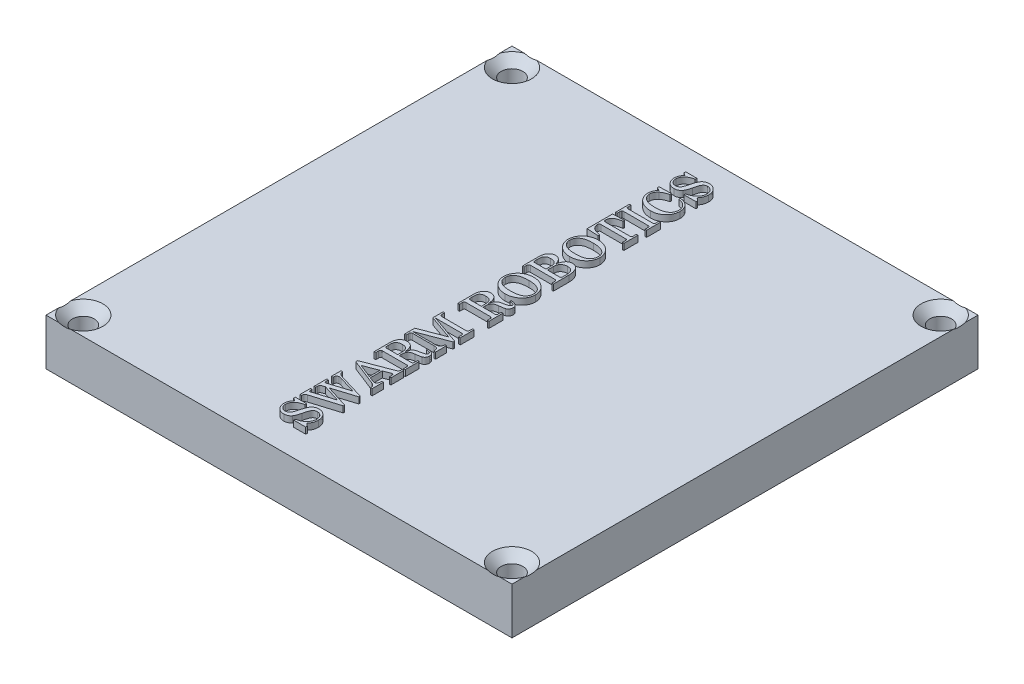
from build123d import *

# Parameters (mm, degrees)
SKETCH1_W                                       = 150
SKETCH1_H                                       = 150
BOSS_EXTRUDE1_DEPTH                             = 15
CSK_FOR_M6_OVAL_HEAD_MACHINE_SCREW2_D           = 7
CSK_FOR_M6_OVAL_HEAD_MACHINE_SCREW2_CSINK_D     = 12.6
CSK_FOR_M6_OVAL_HEAD_MACHINE_SCREW2_CSINK_ANGLE = 90
MIRROR2_COPY_1_D                                = 7
MIRROR2_COPY_1_CSINK_D                          = 12.6
MIRROR2_COPY_1_CSINK_ANGLE                      = 90
BOSS_EXTRUDE2_DEPTH                             = 2


with BuildPart() as part:
    # Sketch1 → Boss-Extrude1 (new body)
    with BuildSketch(Plane(origin=(0, 0, 0), x_dir=(1, 0, 0), z_dir=(0, 1, 0))):
        Rectangle(SKETCH1_W, SKETCH1_H)
    extrude(amount=BOSS_EXTRUDE1_DEPTH)

    # CSK for M6 Oval Head Machine Screw2 (through all)
    with Locations(Plane(origin=(69, 15, -69), x_dir=(0, 0, 1), z_dir=(0, 1, 0))):
        with Locations((0, 0)):
            csk_for_m6_oval_head_machine_screw2 = CounterSinkHole(CSK_FOR_M6_OVAL_HEAD_MACHINE_SCREW2_D / 2, CSK_FOR_M6_OVAL_HEAD_MACHINE_SCREW2_CSINK_D / 2, counter_sink_angle=CSK_FOR_M6_OVAL_HEAD_MACHINE_SCREW2_CSINK_ANGLE)

    # Mirror1: CSK for M6 Oval Head Machine Screw2 across plane
    add(csk_for_m6_oval_head_machine_screw2.mirror(Plane(origin=(0, 0, 0), x_dir=(0, 0, 1), z_dir=(1, 0, 0))), mode=Mode.SUBTRACT)

    # Mirror2: CSK for M6 Oval Head Machine Screw2 across plane
    add(csk_for_m6_oval_head_machine_screw2.mirror(Plane.XY), mode=Mode.SUBTRACT)

    # Mirror2 copy 1 (through all)
    with Locations(Plane(origin=(-69, 15, 69), x_dir=(0, 0, -1), z_dir=(0, 1, 0))):
        with Locations((0, 0)):
            CounterSinkHole(MIRROR2_COPY_1_D / 2, MIRROR2_COPY_1_CSINK_D / 2, counter_sink_angle=MIRROR2_COPY_1_CSINK_ANGLE)

    # Sketch9 → Boss-Extrude2 (add)
    # profile 1 of 13: a face of its own
    with BuildSketch(Plane(origin=(0, 15, 0), x_dir=(1, 0, 0), z_dir=(0, 1, 0))):
        with BuildLine():
            Line((-9.102564103, -60.869391026), (-10, -60.256410256))
            Line((-10, -60.256410256), (-10, -59.743589744))
            Line((-10, -59.743589744), (-6.41025641, -59.743589744))
            Line((-6.41025641, -59.743589744), (-6.41025641, -60.256410256))
            add(Edge.make_bspline(
                [(-6.41025641, -60.256410256), (-6.544827952, -60.291191752), (-6.806997627, -60.358952388), (-7.182972091, -60.478823477), (-7.530879522, -60.610919054), (-7.850365792, -60.75479008), (-8.141786151, -60.911010812), (-8.406235524, -61.078881311), (-8.640721757, -61.261670893), (-8.848805526, -61.45455951), (-9.029332045, -61.658043438), (-9.187272749, -61.868158568), (-9.316982878, -62.088291006), (-9.426918751, -62.313337546), (-9.511356985, -62.547077274), (-9.571401765, -62.788696168), (-9.608579791, -63.037707439), (-9.613105333, -63.206336347), (-9.615384615, -63.291266026)],
                knots=[0, 0, 0, 0, 1.392564724, 2.712967664, 3.951873449, 5.119722724, 6.221370984, 7.262600271, 8.254348041, 9.196438926, 10.101595302, 10.976777585, 11.825919055, 12.65785703, 13.483312273, 14.310934069, 15.149304651, 16, 16, 16, 16], degree=3))
            add(Edge.make_bspline(
                [(-9.615384615, -63.291266026), (-9.613825819, -63.361434914), (-9.610758158, -63.499525046), (-9.587245835, -63.701617909), (-9.544242096, -63.8937992), (-9.486577343, -64.076427781), (-9.412176076, -64.249623726), (-9.321526805, -64.41266974), (-9.214891686, -64.566342582), (-9.091117146, -64.707235036), (-8.955482518, -64.834392089), (-8.812511852, -64.947609492), (-8.662618307, -65.045148791), (-8.502774268, -65.1204535), (-8.337328075, -65.181484121), (-8.164919767, -65.225454796), (-7.98496716, -65.252473262), (-7.862675906, -65.255082994), (-7.800480769, -65.256410256)],
                knots=[0, 0, 0, 0, 1.126505813, 2.216927498, 3.259995162, 4.28393459, 5.287637521, 6.281038707, 7.274382041, 8.284932371, 9.286055453, 10.255507275, 11.210144667, 12.149978701, 13.086075318, 14.037758383, 15.002039124, 16, 16, 16, 16], degree=3))
            add(Edge.make_bspline(
                [(-7.800480769, -65.256410256), (-7.72347796, -65.254652018), (-7.573687234, -65.251231781), (-7.35724429, -65.208724691), (-7.154675748, -65.14542731), (-6.966763841, -65.054692334), (-6.794841384, -64.937046297), (-6.63899865, -64.793787926), (-6.503278483, -64.622862901), (-6.400897463, -64.461917142), (-6.328619674, -64.310565231), (-6.267366971, -64.174579338), (-6.209141611, -64.01382886), (-6.146179713, -63.831976422), (-6.085812111, -63.626638449), (-6.018047249, -63.400443422), (-5.953312603, -63.15009243), (-5.909968695, -62.975462961), (-5.887419872, -62.884615385)],
                knots=[0, 0, 0, 0, 1.100368056, 2.140505393, 3.143779119, 4.130997962, 5.114278199, 6.115091689, 7.147784748, 8.229532711, 8.836358386, 9.546551851, 10.362967398, 11.281580888, 12.300253328, 13.42511758, 14.660467625, 16, 16, 16, 16], degree=3))
            add(Edge.make_bspline(
                [(-5.887419872, -62.884615385), (-5.855317748, -62.756247424), (-5.793462049, -62.508902737), (-5.693976571, -62.153484009), (-5.59897131, -61.825908336), (-5.504525395, -61.525891885), (-5.41171393, -61.254155533), (-5.317054524, -61.011371645), (-5.225503127, -60.796566424), (-5.107352548, -60.550964561), (-4.949374762, -60.280008148), (-4.728400461, -60.000299518), (-4.489332454, -59.758718381), (-4.222263548, -59.56502944), (-3.930831831, -59.414925802), (-3.617561235, -59.306063891), (-3.279041576, -59.243534122), (-3.046466233, -59.235108624), (-2.926682692, -59.230769231)],
                knots=[0, 0, 0, 0, 1.232460684, 2.374756126, 3.437580973, 4.409330108, 5.304298898, 6.111664469, 6.836067356, 7.478657222, 8.649880348, 9.748535734, 10.790871134, 11.80603788, 12.807488768, 13.834250002, 14.884571346, 16, 16, 16, 16], degree=3))
            add(Edge.make_bspline(
                [(-2.926682692, -59.230769231), (-2.81903142, -59.233345887), (-2.607554489, -59.238407634), (-2.297630948, -59.281759776), (-2.000582923, -59.35124012), (-1.718919694, -59.451709563), (-1.450453152, -59.578943758), (-1.198431942, -59.736451322), (-0.957696469, -59.919513538), (-0.735323764, -60.130894406), (-0.533561504, -60.364574027), (-0.356373391, -60.616183397), (-0.20519954, -60.883544098), (-0.082002029, -61.168158828), (0.011263358, -61.470056077), (0.079741982, -61.787658137), (0.119985077, -62.1216964), (0.12542822, -62.349650859), (0.128205128, -62.465945513)],
                knots=[0, 0, 0, 0, 1.035658224, 2.034512154, 3.005628986, 3.967064647, 4.907039703, 5.859389846, 6.822134825, 7.813163928, 8.806482506, 9.788910089, 10.770180897, 11.757493967, 12.767695604, 13.806340449, 14.880869098, 16, 16, 16, 16], degree=3))
            add(Edge.make_bspline(
                [(0.128205128, -62.465945513), (0.125259288, -62.592312212), (0.119454715, -62.84130901), (0.069328989, -63.20867137), (-0.009411074, -63.563143574), (-0.123476918, -63.904830446), (-0.26721859, -64.234038044), (-0.445476959, -64.549898084), (-0.653626387, -64.854580516), (-0.81545962, -65.042852422), (-0.897435897, -65.138221154)],
                knots=[0, 0, 0, 0, 1.034489663, 2.038389989, 3.030740084, 4.004349409, 4.983823211, 5.968063708, 6.970727015, 8, 8, 8, 8], degree=3))
            Line((-0.897435897, -65.138221154), (0, -65.897435897))
            Line((0, -65.897435897), (0, -66.41025641))
            Line((0, -66.41025641), (-3.846153846, -66.41025641))
            Line((-3.846153846, -66.41025641), (-3.846153846, -65.897435897))
            add(Edge.make_bspline(
                [(-3.846153846, -65.897435897), (-3.715503646, -65.872661025), (-3.459534739, -65.824122278), (-3.090042853, -65.719826747), (-2.739480577, -65.599132363), (-2.411503381, -65.452840795), (-2.105141999, -65.28536391), (-1.818268354, -65.09906474), (-1.554180832, -64.888200917), (-1.311888587, -64.657992196), (-1.095283099, -64.413570122), (-0.905556697, -64.159684623), (-0.743069407, -63.898600621), (-0.614293839, -63.627617544), (-0.509108898, -63.35092123), (-0.438466125, -63.065010335), (-0.391994787, -62.77195728), (-0.387083548, -62.573629), (-0.384615385, -62.473958333)],
                knots=[0, 0, 0, 0, 1.203719607, 2.358318566, 3.47328295, 4.558801277, 5.606051957, 6.632495192, 7.652434195, 8.661868393, 9.655677539, 10.606270611, 11.52930665, 12.435349776, 13.319330832, 14.205171381, 15.098001729, 16, 16, 16, 16], degree=3))
            add(Edge.make_bspline(
                [(-0.384615385, -62.473958333), (-0.386857148, -62.39444201), (-0.391258495, -62.238324281), (-0.416412842, -62.009438066), (-0.463213307, -61.791696138), (-0.527068907, -61.585024678), (-0.608788557, -61.388870116), (-0.712951077, -61.206590733), (-0.830389632, -61.032284162), (-0.96859519, -60.874061293), (-1.118322524, -60.730228427), (-1.276476976, -60.602919944), (-1.444224183, -60.496461813), (-1.618852967, -60.407330468), (-1.802366624, -60.338919232), (-1.993177591, -60.291031208), (-2.19197233, -60.262337173), (-2.326961037, -60.258412603), (-2.395833333, -60.256410256)],
                knots=[0, 0, 0, 0, 1.141184085, 2.24053454, 3.298523207, 4.331930668, 5.340931447, 6.340425213, 7.339689331, 8.351914852, 9.348050511, 10.316191482, 11.259745609, 12.193863714, 13.124634419, 14.063457944, 15.01196107, 16, 16, 16, 16], degree=3))
            add(Edge.make_bspline(
                [(-2.395833333, -60.256410256), (-2.472813666, -60.259000874), (-2.623306513, -60.264065406), (-2.842212834, -60.306801928), (-3.046047862, -60.379230903), (-3.23537303, -60.480939156), (-3.409716993, -60.612607544), (-3.568217729, -60.778425503), (-3.709247566, -60.978322952), (-3.815019831, -61.170866511), (-3.893053555, -61.352764148), (-3.956456536, -61.521419908), (-4.02495687, -61.718639254), (-4.091540613, -61.947500817), (-4.166366935, -62.204016229), (-4.241863161, -62.492208834), (-4.322120541, -62.809208397), (-4.374033944, -63.031426997), (-4.401041667, -63.147035256)],
                knots=[0, 0, 0, 0, 0.958623361, 1.874062547, 2.766215603, 3.644762723, 4.541714, 5.477349128, 6.491011476, 7.582038639, 8.208066525, 8.955982453, 9.826931869, 10.808780873, 11.92539716, 13.156515328, 14.520689466, 16, 16, 16, 16], degree=3))
            add(Edge.make_bspline(
                [(-4.401041667, -63.147035256), (-4.432435579, -63.274742281), (-4.492952563, -63.520918802), (-4.591149913, -63.874491507), (-4.692316306, -64.198921995), (-4.798764006, -64.493307078), (-4.905663556, -64.758950999), (-5.018239223, -64.993255406), (-5.130940514, -65.200311924), (-5.215973468, -65.322502267), (-5.256410256, -65.380608974)],
                knots=[0, 0, 0, 0, 1.311989861, 2.529078561, 3.660524616, 4.701531557, 5.651641921, 6.51576602, 7.294183583, 8, 8, 8, 8], degree=3))
            add(Edge.make_bspline(
                [(-5.256410256, -65.380608974), (-5.314217046, -65.452183406), (-5.42847529, -65.593654136), (-5.625914819, -65.777861053), (-5.840608528, -65.935111597), (-6.074822873, -66.060265917), (-6.324567084, -66.162625908), (-6.593553395, -66.23138251), (-6.87959993, -66.274619292), (-7.076492826, -66.279531626), (-7.177483974, -66.282051282)],
                knots=[0, 0, 0, 0, 1.000126293, 1.976803651, 2.928762077, 3.887903112, 4.859377268, 5.858658592, 6.90165398, 8, 8, 8, 8], degree=3))
            add(Edge.make_bspline(
                [(-7.177483974, -66.282051282), (-7.283091263, -66.279091772), (-7.490323194, -66.27328436), (-7.793763234, -66.235557248), (-8.08261943, -66.169623265), (-8.355649378, -66.07409436), (-8.616519832, -65.956356632), (-8.861407198, -65.809263673), (-9.091092773, -65.635363616), (-9.304885046, -65.437780047), (-9.497847387, -65.218695722), (-9.667167133, -64.983284167), (-9.810762574, -64.73314666), (-9.926769832, -64.467640575), (-10.017844316, -64.187217965), (-10.08028022, -63.891705831), (-10.122792458, -63.58229438), (-10.126378921, -63.370874854), (-10.128205128, -63.263221154)],
                knots=[0, 0, 0, 0, 1.070284952, 2.100207477, 3.093367464, 4.06713243, 5.027090138, 5.98921606, 6.955592735, 7.942090249, 8.934581387, 9.909286507, 10.876255376, 11.851970152, 12.840693479, 13.858786802, 14.909705613, 16, 16, 16, 16], degree=3))
            add(Edge.make_bspline(
                [(-10.128205128, -63.263221154), (-10.126034565, -63.158176004), (-10.121740753, -62.950375481), (-10.071446107, -62.643809746), (-10.00178807, -62.34357465), (-9.895140791, -62.0497711), (-9.754720568, -61.756952617), (-9.574574425, -61.46306711), (-9.357325677, -61.162597832), (-9.18963028, -60.969596074), (-9.102564103, -60.869391026)],
                knots=[0, 0, 0, 0, 0.943541933, 1.866516513, 2.786831557, 3.711678853, 4.670361474, 5.702081918, 6.806938361, 8, 8, 8, 8], degree=3))
        make_face()
    # profile 2 of 13: a face of its own
    with BuildSketch(Plane(origin=(0, 15, 0), x_dir=(1, 0, 0), z_dir=(0, 1, 0))):
        with BuildLine():
            Line((-10, -58.205128205), (-10, -54.871794872))
            Line((-10, -54.871794872), (-9.487179487, -54.871794872))
            Line((-9.487179487, -54.871794872), (-9.487179487, -55.090144231))
            add(Edge.make_bspline(
                [(-9.487179487, -55.090144231), (-9.485761169, -55.164258825), (-9.483202546, -55.297960397), (-9.472116313, -55.477267788), (-9.446846434, -55.61305771), (-9.414465547, -55.712847001), (-9.365226035, -55.781149464), (-9.303485353, -55.823512199), (-9.233601795, -55.854797519), (-9.181735983, -55.856488583), (-9.154647436, -55.857371795)],
                knots=[0, 0, 0, 0, 1.894161023, 3.417036937, 4.581257055, 5.417808969, 6.076267596, 6.687039948, 7.314265444, 8, 8, 8, 8], degree=3))
            add(Edge.make_bspline(
                [(-9.154647436, -55.857371795), (-9.131844853, -55.856035767), (-9.079548723, -55.85297168), (-8.993569458, -55.829933332), (-8.889806772, -55.798567581), (-8.81594049, -55.770414955), (-8.776041667, -55.755208333)],
                knots=[0, 0, 0, 0, 0.694477067, 1.592734596, 2.699717214, 4, 4, 4, 4], degree=3))
            Line((-8.776041667, -55.755208333), (-8.649839744, -55.715144231))
            Line((-8.649839744, -55.715144231), (-2.371794872, -53.782051282))
            Line((-2.371794872, -53.782051282), (-8.048878205, -52.003205128))
            add(Edge.make_bspline(
                [(-8.048878205, -52.003205128), (-8.133715365, -52.031137357), (-8.294968293, -52.08422911), (-8.522498526, -52.16104474), (-8.720738822, -52.234524301), (-8.893303933, -52.296715459), (-9.035667009, -52.359824797), (-9.152666474, -52.411931933), (-9.23999455, -52.460680941), (-9.323604825, -52.515075182), (-9.394797977, -52.610387153), (-9.448647181, -52.752840063), (-9.481567966, -52.93259127), (-9.485195637, -53.064747499), (-9.487179487, -53.137019231)],
                knots=[0, 0, 0, 0, 1.583744954, 3.01027887, 4.257508604, 5.332844925, 6.260965941, 7.018434368, 7.601475957, 8.035044787, 8.7765214, 9.6581678, 10.719331894, 12, 12, 12, 12], degree=3))
            Line((-9.487179487, -53.137019231), (-9.487179487, -53.717948718))
            Line((-9.487179487, -53.717948718), (-10, -53.717948718))
            Line((-10, -53.717948718), (-10, -49.615384615))
            Line((-10, -49.615384615), (-9.487179487, -49.615384615))
            Line((-9.487179487, -49.615384615), (-9.487179487, -50.022035256))
            add(Edge.make_bspline(
                [(-9.487179487, -50.022035256), (-9.486019399, -50.102843793), (-9.4839169, -50.249298099), (-9.469885519, -50.446522568), (-9.443619018, -50.597938473), (-9.407358242, -50.710002516), (-9.353138184, -50.786326503), (-9.289356253, -50.83817403), (-9.213514325, -50.870523834), (-9.158981196, -50.873731679), (-9.130608974, -50.875400641)],
                knots=[0, 0, 0, 0, 1.879627548, 3.40656522, 4.591383616, 5.451125785, 6.119067939, 6.737517921, 7.343162167, 8, 8, 8, 8], degree=3))
            add(Edge.make_bspline(
                [(-9.130608974, -50.875400641), (-9.085579975, -50.873911439), (-8.997799081, -50.871008342), (-8.913332997, -50.847019712), (-8.872195513, -50.835336538)],
                knots=[0, 0, 0, 0, 1.025940781, 2, 2, 2, 2], degree=3))
            Line((-8.872195513, -50.835336538), (-2.371794872, -48.782051282))
            Line((-2.371794872, -48.782051282), (-7.994791667, -47.089342949))
            add(Edge.make_bspline(
                [(-7.994791667, -47.089342949), (-8.100962794, -47.059811954), (-8.306268336, -47.002707192), (-8.519050348, -46.992235755), (-8.621794872, -46.987179487)],
                knots=[0, 0, 0, 0, 1.034274343, 2, 2, 2, 2], degree=3))
            add(Edge.make_bspline(
                [(-8.621794872, -46.987179487), (-8.691455549, -46.988927573), (-8.821971808, -46.992202786), (-9.002925415, -47.030383273), (-9.156238447, -47.091774259), (-9.280391764, -47.181968556), (-9.374439505, -47.297961652), (-9.443119014, -47.437131967), (-9.478864844, -47.601751147), (-9.484314074, -47.718865514), (-9.487179487, -47.780448718)],
                knots=[0, 0, 0, 0, 1.239352046, 2.322050231, 3.276562577, 4.161755303, 5.023943661, 5.91248789, 6.90230645, 8, 8, 8, 8], degree=3))
            Line((-9.487179487, -47.780448718), (-9.487179487, -48.076923077))
            Line((-9.487179487, -48.076923077), (-10, -48.076923077))
            Line((-10, -48.076923077), (-10, -45))
            Line((-10, -45), (-9.487179487, -45))
            add(Edge.make_bspline(
                [(-9.487179487, -45), (-9.477746436, -45.070999408), (-9.459818406, -45.205937674), (-9.414850984, -45.3952851), (-9.361953133, -45.562949252), (-9.295772874, -45.710362799), (-9.212317426, -45.839158253), (-9.117875622, -45.958772567), (-9.006493027, -46.069082084), (-8.876378622, -46.175153789), (-8.715336059, -46.275363829), (-8.512982608, -46.369669562), (-8.27041452, -46.470225068), (-8.090752893, -46.529067668), (-7.994791667, -46.560496795)],
                knots=[0, 0, 0, 0, 1.104909104, 2.099940305, 2.999539851, 3.815871034, 4.585032206, 5.362504419, 6.164194353, 6.999626971, 7.949038862, 9.083033863, 10.441984244, 12, 12, 12, 12], degree=3))
            Line((-7.994791667, -46.560496795), (0.128205128, -49.006410256))
            Line((0.128205128, -49.006410256), (0.128205128, -49.439102564))
            Line((0.128205128, -49.439102564), (-7.151442308, -51.72275641))
            Line((-7.151442308, -51.72275641), (0.128205128, -54.002403846))
            Line((0.128205128, -54.002403846), (0.128205128, -54.451121795))
            Line((0.128205128, -54.451121795), (-8.649839744, -57.153445513))
            add(Edge.make_bspline(
                [(-8.649839744, -57.153445513), (-8.728546383, -57.180608943), (-8.873899299, -57.2307735), (-9.066542322, -57.322001667), (-9.215323586, -57.41998221), (-9.329588592, -57.525537624), (-9.402206694, -57.657270664), (-9.454077678, -57.811627184), (-9.482300797, -57.998476954), (-9.485474949, -58.132927471), (-9.487179487, -58.205128205)],
                knots=[0, 0, 0, 0, 1.343815178, 2.481715109, 3.429547902, 4.214755833, 4.963598606, 5.829541321, 6.83445066, 8, 8, 8, 8], degree=3))
            Line((-9.487179487, -58.205128205), (-10, -58.205128205))
        make_face()
    # profile 3 of 13: a face of its own
    with BuildSketch(Plane(origin=(0, 15, 0), x_dir=(1, 0, 0), z_dir=(0, 1, 0))):
        with BuildLine():
            Line((-10.128205128, -40.132211538), (-10.128205128, -39.525240385))
            Line((-10.128205128, -39.525240385), (-1.073717949, -36.067708333))
            add(Edge.make_bspline(
                [(-1.073717949, -36.067708333), (-1.029050596, -36.048203331), (-0.942755407, -36.010520598), (-0.825960285, -35.935611365), (-0.728517389, -35.844358222), (-0.650216489, -35.738391123), (-0.586060067, -35.62032), (-0.543009695, -35.48657105), (-0.516449125, -35.338936396), (-0.514060767, -35.23583261), (-0.512820513, -35.182291667)],
                knots=[0, 0, 0, 0, 1.039358522, 2.007990974, 2.945824694, 3.87232466, 4.809725, 5.801366587, 6.858267855, 8, 8, 8, 8], degree=3))
            Line((-0.512820513, -35.182291667), (-0.512820513, -34.871794872))
            Line((-0.512820513, -34.871794872), (0, -34.871794872))
            Line((0, -34.871794872), (0, -38.974358974))
            Line((0, -38.974358974), (-0.512820513, -38.974358974))
            Line((-0.512820513, -38.974358974), (-0.512820513, -38.647836538))
            add(Edge.make_bspline(
                [(-0.512820513, -38.647836538), (-0.513780971, -38.548893185), (-0.515556704, -38.365962765), (-0.542152456, -38.115765361), (-0.578382413, -37.909019031), (-0.627193351, -37.793906088), (-0.649038462, -37.742387821)],
                knots=[0, 0, 0, 0, 1.28614417, 2.377874675, 3.274025287, 4, 4, 4, 4], degree=3))
            add(Edge.make_bspline(
                [(-0.649038462, -37.742387821), (-0.665754938, -37.715351989), (-0.698220036, -37.662845657), (-0.767662022, -37.602294479), (-0.852763856, -37.569303981), (-0.912524447, -37.564559379), (-0.943509615, -37.562099359)],
                knots=[0, 0, 0, 0, 1.044845995, 2.029197152, 2.978161746, 4, 4, 4, 4], degree=3))
            add(Edge.make_bspline(
                [(-0.943509615, -37.562099359), (-0.983935971, -37.564284037), (-1.068478376, -37.568852786), (-1.148267935, -37.597323076), (-1.189903846, -37.612179487)],
                knots=[0, 0, 0, 0, 0.9563569, 2, 2, 2, 2], degree=3))
            Line((-1.189903846, -37.612179487), (-3.333333333, -38.431490385))
            Line((-3.333333333, -38.431490385), (-3.333333333, -42.271634615))
            Line((-3.333333333, -42.271634615), (-2.103365385, -42.756410256))
            add(Edge.make_bspline(
                [(-2.103365385, -42.756410256), (-2.026233774, -42.783517904), (-1.881221046, -42.834482144), (-1.673653951, -42.889930791), (-1.491727877, -42.927836966), (-1.378350428, -42.93390391), (-1.326121795, -42.936698718)],
                knots=[0, 0, 0, 0, 1.224093926, 2.301380688, 3.217511364, 4, 4, 4, 4], degree=3))
            add(Edge.make_bspline(
                [(-1.326121795, -42.936698718), (-1.271523334, -42.932738729), (-1.163995366, -42.924939798), (-1.009309256, -42.864908681), (-0.87012672, -42.766034981), (-0.744601199, -42.630810216), (-0.637214285, -42.460370531), (-0.565685445, -42.250669788), (-0.518184471, -42.009352084), (-0.514680714, -41.836540281), (-0.512820513, -41.744791667)],
                knots=[0, 0, 0, 0, 0.813711561, 1.602549765, 2.440574529, 3.343408092, 4.342114456, 5.423907891, 6.632310536, 8, 8, 8, 8], degree=3))
            Line((-0.512820513, -41.744791667), (-0.512820513, -41.41025641))
            Line((-0.512820513, -41.41025641), (0, -41.41025641))
            Line((0, -41.41025641), (0, -45))
            Line((0, -45), (-0.512820513, -45))
            add(Edge.make_bspline(
                [(-0.512820513, -45), (-0.515554842, -44.906950595), (-0.520769593, -44.729492285), (-0.569158295, -44.478110987), (-0.648177355, -44.25632147), (-0.765135846, -44.060322568), (-0.929934294, -43.885841647), (-1.149703571, -43.727159579), (-1.423892775, -43.572652041), (-1.63152743, -43.485958135), (-1.742788462, -43.439503205)],
                knots=[0, 0, 0, 0, 1.035995544, 1.975789299, 2.839734187, 3.647508015, 4.500456235, 5.494560483, 6.657460216, 8, 8, 8, 8], degree=3))
            Line((-1.742788462, -43.439503205), (-10.128205128, -40.132211538))
        make_face()
        Polygon((-8.28125, -40.320512821), (-3.846153846, -42.069310897), (-3.846153846, -38.627804487), align=None, mode=Mode.SUBTRACT)
    # profile 4 of 13: a face of its own
    with BuildSketch(Plane(origin=(0, 15, 0), x_dir=(1, 0, 0), z_dir=(0, 1, 0))):
        with BuildLine():
            Line((-10, -34.358974359), (-10, -29.266826923))
            add(Edge.make_bspline(
                [(-10, -29.266826923), (-9.998361019, -29.146556146), (-9.995176933, -28.912903265), (-9.962407844, -28.572829961), (-9.90953601, -28.253793245), (-9.832777186, -27.955873683), (-9.737241221, -27.677775387), (-9.619384528, -27.420177626), (-9.477926866, -27.184494234), (-9.317652688, -26.969555792), (-9.139830194, -26.777318545), (-8.946590127, -26.60962903), (-8.739313017, -26.468735839), (-8.518639822, -26.353688206), (-8.285097817, -26.26263007), (-8.037595525, -26.199243494), (-7.77704464, -26.159861649), (-7.5989686, -26.155879906), (-7.508012821, -26.153846154)],
                knots=[0, 0, 0, 0, 1.283751367, 2.493974109, 3.643744454, 4.733090268, 5.774734765, 6.779547686, 7.751553674, 8.704016143, 9.637288333, 10.542023125, 11.429859275, 12.306780114, 13.193814452, 14.099896494, 15.029485402, 16, 16, 16, 16], degree=3))
            add(Edge.make_bspline(
                [(-7.508012821, -26.153846154), (-7.399485786, -26.157158098), (-7.186442104, -26.1636596), (-6.877702483, -26.230752595), (-6.586549502, -26.335293316), (-6.315840562, -26.482828741), (-6.065311457, -26.667177463), (-5.843686186, -26.893072265), (-5.648089828, -27.154523937), (-5.507677298, -27.400951025), (-5.410553385, -27.623339883), (-5.340114947, -27.814368505), (-5.276859332, -28.028687681), (-5.219632584, -28.265639841), (-5.165179516, -28.524006015), (-5.117744028, -28.804735153), (-5.075357558, -29.107990285), (-5.053430545, -29.318164658), (-5.042067308, -29.427083333)],
                knots=[0, 0, 0, 0, 1.137504455, 2.232974849, 3.299364406, 4.374949024, 5.457043981, 6.552245328, 7.683384679, 8.876030598, 9.519306381, 10.228841964, 11.011546244, 11.863133146, 12.786793189, 13.782266869, 14.850704058, 16, 16, 16, 16], degree=3))
            add(Edge.make_bspline(
                [(-5.042067308, -29.427083333), (-5.020441414, -29.348837858), (-4.978725868, -29.197905242), (-4.912092082, -28.982553155), (-4.849165359, -28.784641137), (-4.782563039, -28.607563849), (-4.718823273, -28.448126578), (-4.655440813, -28.30800124), (-4.591269939, -28.186838427), (-4.506756527, -28.051583135), (-4.389731336, -27.903679456), (-4.234080025, -27.745505114), (-4.059379041, -27.605545336), (-3.896697881, -27.503385528), (-3.746437166, -27.428942452), (-3.605545667, -27.376000146), (-3.44037404, -27.319420494), (-3.247877093, -27.266975486), (-3.030897766, -27.212542526), (-2.787714436, -27.158648012), (-2.51846856, -27.105058721), (-2.329784735, -27.071008941), (-2.231570513, -27.053285256)],
                knots=[0, 0, 0, 0, 1.206492457, 2.327279135, 3.350436778, 4.292498105, 5.138428421, 5.902306954, 6.577185609, 7.174730841, 8.270633718, 9.372452685, 10.466736532, 11.59028815, 12.220564325, 12.95592932, 13.82528877, 14.815024329, 15.919878615, 17.150299556, 18.516666096, 20, 20, 20, 20], degree=3))
            add(Edge.make_bspline(
                [(-2.231570513, -27.053285256), (-2.160634054, -27.04067184), (-2.022860464, -27.016173922), (-1.825137638, -26.968362488), (-1.640340471, -26.922626068), (-1.472779552, -26.867036328), (-1.318960448, -26.812915985), (-1.183168417, -26.749049863), (-1.058804421, -26.686750683), (-0.985111821, -26.636736395), (-0.949519231, -26.612580128)],
                knots=[0, 0, 0, 0, 1.265749521, 2.458353012, 3.574008563, 4.609330042, 5.559711238, 6.436626249, 7.244910327, 8, 8, 8, 8], degree=3))
            add(Edge.make_bspline(
                [(-0.949519231, -26.612580128), (-0.903611492, -26.576545993), (-0.818186186, -26.509493529), (-0.71504984, -26.395248108), (-0.65432024, -26.26996975), (-0.64537838, -26.183781728), (-0.641025641, -26.141826923)],
                knots=[0, 0, 0, 0, 1.198230002, 2.229671236, 3.138235264, 4, 4, 4, 4], degree=3))
            add(Edge.make_bspline(
                [(-0.641025641, -26.141826923), (-0.645723646, -26.098389628), (-0.655371905, -26.00918278), (-0.724386618, -25.880690954), (-0.837193891, -25.76399065), (-0.95773021, -25.671574703), (-1.076474336, -25.600556825), (-1.186819993, -25.554242032), (-1.312487339, -25.51133482), (-1.454939424, -25.476813271), (-1.613121993, -25.444258935), (-1.787710934, -25.418741775), (-1.9782542, -25.399198214), (-2.110681137, -25.389601579), (-2.179487179, -25.384615385)],
                knots=[0, 0, 0, 0, 0.841343571, 1.727861014, 2.764099589, 3.974291646, 4.665346808, 5.442815915, 6.290915778, 7.239894431, 8.284201009, 9.423888924, 10.661510912, 12, 12, 12, 12], degree=3))
            Line((-2.179487179, -25.384615385), (-2.179487179, -25))
            add(Edge.make_bspline(
                [(-2.179487179, -25), (-2.085897286, -25.006251764), (-1.904931868, -25.018340176), (-1.643096613, -25.053809176), (-1.399184275, -25.096056641), (-1.173113669, -25.152851728), (-0.964854293, -25.219427961), (-0.775435083, -25.301095069), (-0.602152084, -25.389372534), (-0.44857815, -25.49343603), (-0.310992137, -25.606425126), (-0.194917022, -25.734934988), (-0.092393051, -25.87078508), (-0.013005459, -26.021739845), (0.052886411, -26.182177391), (0.094713945, -26.355894935), (0.125181173, -26.539393398), (0.127179494, -26.665860327), (0.128205128, -26.730769231)],
                knots=[0, 0, 0, 0, 1.388619173, 2.685034022, 3.910855896, 5.05242231, 6.134359489, 7.144509158, 8.104279207, 9.009309151, 9.886691345, 10.733449783, 11.568054138, 12.399842047, 13.251838275, 14.12961043, 15.040026222, 16, 16, 16, 16], degree=3))
            add(Edge.make_bspline(
                [(0.128205128, -26.730769231), (0.125120663, -26.811787488), (0.119103006, -26.969850582), (0.072255615, -27.19900793), (-0.006327144, -27.412117098), (-0.116893591, -27.606723949), (-0.256811003, -27.782086983), (-0.428067159, -27.9332359), (-0.628030852, -28.063809984), (-0.778064627, -28.12666753), (-0.85536859, -28.159054487)],
                knots=[0, 0, 0, 0, 1.047466926, 2.043562405, 3.011083507, 3.974276326, 4.926679892, 5.899392524, 6.917675148, 8, 8, 8, 8], degree=3))
            add(Edge.make_bspline(
                [(-0.85536859, -28.159054487), (-0.891959746, -28.171513757), (-0.976246106, -28.200213219), (-1.122939738, -28.237037838), (-1.306294857, -28.274250521), (-1.526544787, -28.314696175), (-1.784028877, -28.353120197), (-2.07760107, -28.396293014), (-2.408380461, -28.437340292), (-2.641547212, -28.464994105), (-2.764423077, -28.479567308)],
                knots=[0, 0, 0, 0, 0.478390711, 1.10195509, 1.870434605, 2.794664839, 3.873792197, 5.093131774, 6.468118011, 8, 8, 8, 8], degree=3))
            add(Edge.make_bspline(
                [(-2.764423077, -28.479567308), (-2.83664173, -28.487509353), (-2.975439215, -28.50277322), (-3.174692973, -28.536713511), (-3.358194178, -28.5690372), (-3.525783281, -28.607832608), (-3.677342652, -28.648486894), (-3.811864907, -28.695544898), (-3.931705792, -28.742045081), (-4.0671347, -28.814843305), (-4.220578494, -28.921330678), (-4.383574922, -29.078848522), (-4.526218169, -29.268284328), (-4.650628236, -29.485035515), (-4.750874831, -29.729234141), (-4.818944166, -29.998443196), (-4.865299345, -30.288871013), (-4.869580122, -30.490588924), (-4.871794872, -30.594951923)],
                knots=[0, 0, 0, 0, 1.028337767, 1.976368855, 2.860805683, 3.66573428, 4.411116086, 5.080775043, 5.682905864, 6.228425604, 7.25380437, 8.316839877, 9.422928889, 10.60017225, 11.846588811, 13.146698654, 14.523784592, 16, 16, 16, 16], degree=3))
            Line((-4.871794872, -30.594951923), (-4.871794872, -31.41025641))
            Line((-4.871794872, -31.41025641), (-0.987580128, -31.41025641))
            add(Edge.make_bspline(
                [(-0.987580128, -31.41025641), (-0.949353416, -31.408931838), (-0.877377055, -31.406437824), (-0.779438057, -31.382984722), (-0.697311091, -31.344946696), (-0.65811697, -31.305348892), (-0.639022436, -31.286057692)],
                knots=[0, 0, 0, 0, 1.200207482, 2.259848181, 3.152235397, 4, 4, 4, 4], degree=3))
            add(Edge.make_bspline(
                [(-0.639022436, -31.286057692), (-0.618775267, -31.256796877), (-0.576298484, -31.195410256), (-0.540825589, -31.079686859), (-0.516443532, -30.945931169), (-0.51407729, -30.848842268), (-0.512820513, -30.797275641)],
                knots=[0, 0, 0, 0, 0.826964289, 1.734898464, 2.796941306, 4, 4, 4, 4], degree=3))
            Line((-0.512820513, -30.797275641), (-0.512820513, -29.871794872))
            Line((-0.512820513, -29.871794872), (0, -29.871794872))
            Line((0, -29.871794872), (0, -34.358974359))
            Line((0, -34.358974359), (-0.512820513, -34.358974359))
            Line((-0.512820513, -34.358974359), (-0.512820513, -33.421474359))
            add(Edge.make_bspline(
                [(-0.512820513, -33.421474359), (-0.514119365, -33.373273032), (-0.516555675, -33.282859805), (-0.540443522, -33.157059823), (-0.57909088, -33.050496361), (-0.637231074, -32.965376358), (-0.708785561, -32.899914744), (-0.792246474, -32.852714553), (-0.888561684, -32.826409511), (-0.956035368, -32.822547613), (-0.991586538, -32.820512821)],
                knots=[0, 0, 0, 0, 1.322849184, 2.481323038, 3.503366862, 4.414154492, 5.284122715, 6.146514873, 7.023418293, 8, 8, 8, 8], degree=3))
            Line((-0.991586538, -32.820512821), (-8.974358974, -32.820512821))
            add(Edge.make_bspline(
                [(-8.974358974, -32.820512821), (-9.014510705, -32.822654331), (-9.090407664, -32.826702329), (-9.198375793, -32.851016976), (-9.287719193, -32.90116686), (-9.363530347, -32.966790579), (-9.419679931, -33.053904215), (-9.460158212, -33.159432548), (-9.483172446, -33.284278686), (-9.485792025, -33.373969542), (-9.487179487, -33.421474359)],
                knots=[0, 0, 0, 0, 1.066531836, 2.016015794, 2.903845426, 3.757070895, 4.651239732, 5.621644264, 6.74030242, 8, 8, 8, 8], degree=3))
            Line((-9.487179487, -33.421474359), (-9.487179487, -34.358974359))
            Line((-9.487179487, -34.358974359), (-10, -34.358974359))
        make_face()
        with BuildLine():
            Line((-5.384615385, -31.41025641), (-5.384615385, -30.268429487))
            add(Edge.make_bspline(
                [(-5.384615385, -30.268429487), (-5.386459712, -30.174923616), (-5.390034116, -29.993704206), (-5.408872583, -29.72920965), (-5.446301511, -29.480731141), (-5.492076638, -29.246337646), (-5.556798431, -29.028737554), (-5.635751077, -28.827671391), (-5.724668935, -28.639766737), (-5.831400807, -28.469072187), (-5.953722092, -28.31293824), (-6.101425721, -28.180659697), (-6.271287527, -28.06906919), (-6.461683689, -27.976827256), (-6.675070731, -27.907869267), (-6.908837148, -27.854960211), (-7.165406364, -27.82601581), (-7.343682612, -27.822388879), (-7.435897436, -27.820512821)],
                knots=[0, 0, 0, 0, 1.219780648, 2.364000528, 3.455255759, 4.495445104, 5.476454343, 6.411260579, 7.311048402, 8.183444192, 9.03217454, 9.889264337, 10.756427798, 11.675688299, 12.639616213, 13.674945089, 14.797346632, 16, 16, 16, 16], degree=3))
            add(Edge.make_bspline(
                [(-7.435897436, -27.820512821), (-7.560866149, -27.823743419), (-7.798299311, -27.829881366), (-8.135052379, -27.871207426), (-8.429786354, -27.949310908), (-8.684828377, -28.055065719), (-8.898298872, -28.18914439), (-9.079025017, -28.33910161), (-9.219335919, -28.513518943), (-9.310376967, -28.676147066), (-9.362741667, -28.825737946), (-9.396666263, -28.96183869), (-9.423110592, -29.122097252), (-9.44766961, -29.306399228), (-9.46425722, -29.514388538), (-9.478925002, -29.746079793), (-9.486529625, -30.001952565), (-9.486956528, -30.180952389), (-9.487179487, -30.274439103)],
                knots=[0, 0, 0, 0, 1.583655085, 3.008850984, 4.287470889, 5.436237295, 6.492745436, 7.471043957, 8.397359757, 9.31369086, 9.816818369, 10.40166906, 11.088836002, 11.873842162, 12.757075413, 13.731891846, 14.815429128, 16, 16, 16, 16], degree=3))
            add(Edge.make_bspline(
                [(-9.487179487, -30.274439103), (-9.486909864, -30.335880062), (-9.486399777, -30.452117016), (-9.479605366, -30.617033946), (-9.472598044, -30.763423577), (-9.460671099, -30.891742239), (-9.445517544, -31.002298838), (-9.42501282, -31.09435105), (-9.405070399, -31.169204007), (-9.3702287, -31.242084628), (-9.312763417, -31.312073899), (-9.222601473, -31.369227962), (-9.113748552, -31.404504632), (-9.034755361, -31.40824844), (-8.992387821, -31.41025641)],
                knots=[0, 0, 0, 0, 1.568647662, 2.967642889, 4.214124225, 5.310077609, 6.257668504, 7.060264158, 7.718384113, 8.229300808, 9.113412892, 9.988270463, 10.921020519, 12, 12, 12, 12], degree=3))
            Line((-8.992387821, -31.41025641), (-5.384615385, -31.41025641))
        make_face(mode=Mode.SUBTRACT)
    # profile 5 of 13: a face of its own
    with BuildSketch(Plane(origin=(0, 15, 0), x_dir=(1, 0, 0), z_dir=(0, 1, 0))):
        with BuildLine():
            Line((-10, -24.615384615), (-10, -21.286057692))
            Line((-10, -21.286057692), (-2.103365385, -18.269230769))
            Line((-2.103365385, -18.269230769), (-10, -15.494791667))
            Line((-10, -15.494791667), (-10, -12.179487179))
            Line((-10, -12.179487179), (-9.487179487, -12.179487179))
            Line((-9.487179487, -12.179487179), (-9.487179487, -12.990785256))
            add(Edge.make_bspline(
                [(-9.487179487, -12.990785256), (-9.485940579, -13.056968388), (-9.483677791, -13.17784774), (-9.461022709, -13.341821942), (-9.422705544, -13.471605756), (-9.365742908, -13.57175515), (-9.282111188, -13.639858946), (-9.179078012, -13.685138346), (-9.053253292, -13.713159282), (-8.961838381, -13.716264569), (-8.912259615, -13.717948718)],
                knots=[0, 0, 0, 0, 1.461409083, 2.669172297, 3.644102285, 4.438396511, 5.171145089, 5.982913306, 6.9060355, 8, 8, 8, 8], degree=3))
            Line((-8.912259615, -13.717948718), (-1.005608974, -13.717948718))
            add(Edge.make_bspline(
                [(-1.005608974, -13.717948718), (-0.968001448, -13.715507316), (-0.895974468, -13.710831475), (-0.793704257, -13.67868651), (-0.707355188, -13.620111372), (-0.634104674, -13.538281209), (-0.578130102, -13.428155515), (-0.53926706, -13.28817632), (-0.516515255, -13.117055472), (-0.514117249, -12.992197275), (-0.512820513, -12.924679487)],
                knots=[0, 0, 0, 0, 0.852549098, 1.632825705, 2.39692979, 3.190166996, 4.097530733, 5.17047614, 6.469918703, 8, 8, 8, 8], degree=3))
            Line((-0.512820513, -12.924679487), (-0.512820513, -12.179487179))
            Line((-0.512820513, -12.179487179), (0, -12.179487179))
            Line((0, -12.179487179), (0, -16.666666667))
            Line((0, -16.666666667), (-0.512820513, -16.666666667))
            Line((-0.512820513, -16.666666667), (-0.512820513, -15.831330128))
            add(Edge.make_bspline(
                [(-0.512820513, -15.831330128), (-0.513985117, -15.775134873), (-0.516162947, -15.670048819), (-0.541450437, -15.523815211), (-0.585439285, -15.400856248), (-0.645851375, -15.300257428), (-0.721077093, -15.222599938), (-0.806777392, -15.16729675), (-0.902916388, -15.132716857), (-0.970587798, -15.12974376), (-1.005608974, -15.128205128)],
                knots=[0, 0, 0, 0, 1.394235928, 2.607244209, 3.666761408, 4.619311681, 5.498637875, 6.326439516, 7.133902247, 8, 8, 8, 8], degree=3))
            Line((-1.005608974, -15.128205128), (-9.493189103, -15.128205128))
            Line((-9.493189103, -15.128205128), (0, -18.463541667))
            Line((0, -18.463541667), (0, -18.952323718))
            Line((0, -18.952323718), (-9.453125, -22.564102564))
            Line((-9.453125, -22.564102564), (-2.189503205, -22.564102564))
            add(Edge.make_bspline(
                [(-2.189503205, -22.564102564), (-2.087933061, -22.562288089), (-1.898374607, -22.558901767), (-1.634058998, -22.531861681), (-1.40994637, -22.486502784), (-1.223123782, -22.416925358), (-1.068407682, -22.328209993), (-0.932762816, -22.227414303), (-0.818451961, -22.107467728), (-0.716831557, -21.96889807), (-0.637823683, -21.794775628), (-0.577286239, -21.579563197), (-0.535168803, -21.318074544), (-0.520639606, -21.127956008), (-0.512820513, -21.025641026)],
                knots=[0, 0, 0, 0, 1.386964615, 2.588466026, 3.624159651, 4.501561664, 5.297916969, 6.05304807, 6.801208071, 7.552861703, 8.389205714, 9.396400491, 10.598836048, 12, 12, 12, 12], degree=3))
            Line((-0.512820513, -21.025641026), (0, -21.025641026))
            Line((0, -21.025641026), (0, -24.615384615))
            Line((0, -24.615384615), (-0.512820513, -24.615384615))
            add(Edge.make_bspline(
                [(-0.512820513, -24.615384615), (-0.518705111, -24.543180917), (-0.529960675, -24.405075767), (-0.558746071, -24.207268747), (-0.592880323, -24.027325443), (-0.640020215, -23.865660989), (-0.692615378, -23.721541391), (-0.755430367, -23.5950336), (-0.826420565, -23.486350736), (-0.909724288, -23.39545318), (-1.003249228, -23.317148826), (-1.114497058, -23.253385767), (-1.239678646, -23.197184223), (-1.382746585, -23.154187128), (-1.540398427, -23.117221681), (-1.715639, -23.095483762), (-1.906022822, -23.077734357), (-2.038544427, -23.077200398), (-2.107371795, -23.076923077)],
                knots=[0, 0, 0, 0, 1.350483354, 2.583090738, 3.725892514, 4.762339297, 5.719788335, 6.582882983, 7.390965868, 8.131368332, 8.874279225, 9.655834752, 10.514246464, 11.427863634, 12.436719429, 13.530231025, 14.717283121, 16, 16, 16, 16], degree=3))
            Line((-2.107371795, -23.076923077), (-8.994391026, -23.076923077))
            add(Edge.make_bspline(
                [(-8.994391026, -23.076923077), (-9.034642119, -23.07872068), (-9.110249765, -23.082097296), (-9.215052969, -23.110122954), (-9.303166795, -23.157214877), (-9.375345851, -23.226952395), (-9.428466415, -23.324998821), (-9.461893081, -23.452330751), (-9.483332442, -23.610391561), (-9.485819359, -23.726540624), (-9.487179487, -23.790064103)],
                knots=[0, 0, 0, 0, 0.964066467, 1.810902258, 2.577654402, 3.336338785, 4.182417323, 5.216170427, 6.47748631, 8, 8, 8, 8], degree=3))
            Line((-9.487179487, -23.790064103), (-9.487179487, -24.615384615))
            Line((-9.487179487, -24.615384615), (-10, -24.615384615))
        make_face()
    # profile 6 of 13: a face of its own
    with BuildSketch(Plane(origin=(0, 15, 0), x_dir=(1, 0, 0), z_dir=(0, 1, 0))):
        with BuildLine():
            Line((-10, -7.435897436), (-10, -2.34375))
            add(Edge.make_bspline(
                [(-10, -2.34375), (-9.998361019, -2.223479223), (-9.995176933, -1.989826342), (-9.962407844, -1.649753038), (-9.90953601, -1.330716322), (-9.832777186, -1.03279676), (-9.737241221, -0.754698464), (-9.619384528, -0.497100703), (-9.477926866, -0.261417311), (-9.317652688, -0.046478869), (-9.139830194, 0.145758378), (-8.946590127, 0.313447893), (-8.739313017, 0.454341084), (-8.518639822, 0.569388717), (-8.285097817, 0.660446853), (-8.037595525, 0.723833429), (-7.77704464, 0.763215274), (-7.5989686, 0.767197017), (-7.508012821, 0.769230769)],
                knots=[0, 0, 0, 0, 1.283751367, 2.493974109, 3.643744454, 4.733090268, 5.774734765, 6.779547686, 7.751553674, 8.704016143, 9.637288333, 10.542023125, 11.429859275, 12.306780114, 13.193814452, 14.099896494, 15.029485402, 16, 16, 16, 16], degree=3))
            add(Edge.make_bspline(
                [(-7.508012821, 0.769230769), (-7.399485786, 0.765918825), (-7.186442104, 0.759417323), (-6.877702483, 0.692324328), (-6.586549502, 0.587783607), (-6.315840562, 0.440248182), (-6.065311457, 0.25589946), (-5.843686186, 0.030004658), (-5.648089828, -0.231447014), (-5.507677298, -0.477874102), (-5.410553385, -0.70026296), (-5.340114947, -0.891291582), (-5.276859332, -1.105610758), (-5.219632584, -1.342562918), (-5.165179516, -1.600929092), (-5.117744028, -1.88165823), (-5.075357558, -2.184913362), (-5.053430545, -2.395087735), (-5.042067308, -2.50400641)],
                knots=[0, 0, 0, 0, 1.137504455, 2.232974849, 3.299364406, 4.374949024, 5.457043981, 6.552245328, 7.683384679, 8.876030598, 9.519306381, 10.228841964, 11.011546244, 11.863133146, 12.786793189, 13.782266869, 14.850704058, 16, 16, 16, 16], degree=3))
            add(Edge.make_bspline(
                [(-5.042067308, -2.50400641), (-5.020441414, -2.425760935), (-4.978725868, -2.274828319), (-4.912092082, -2.059476232), (-4.849165359, -1.861564214), (-4.782563039, -1.684486926), (-4.718823273, -1.525049655), (-4.655440813, -1.384924317), (-4.591269939, -1.263761503), (-4.506756527, -1.128506212), (-4.389731336, -0.980602533), (-4.234080025, -0.822428191), (-4.059379041, -0.682468413), (-3.896697881, -0.580308605), (-3.746437166, -0.505865529), (-3.605545667, -0.452923223), (-3.44037404, -0.39634357), (-3.247877093, -0.343898563), (-3.030897766, -0.289465603), (-2.787714436, -0.235571089), (-2.51846856, -0.181981798), (-2.329784735, -0.147932018), (-2.231570513, -0.130208333)],
                knots=[0, 0, 0, 0, 1.206492457, 2.327279135, 3.350436778, 4.292498105, 5.138428421, 5.902306954, 6.577185609, 7.174730841, 8.270633718, 9.372452685, 10.466736532, 11.59028815, 12.220564325, 12.95592932, 13.82528877, 14.815024329, 15.919878615, 17.150299556, 18.516666096, 20, 20, 20, 20], degree=3))
            add(Edge.make_bspline(
                [(-2.231570513, -0.130208333), (-2.160634054, -0.117594917), (-2.022860464, -0.093096999), (-1.825137638, -0.045285565), (-1.640340471, 0.000450855), (-1.472779552, 0.056040595), (-1.318960448, 0.110160938), (-1.183168417, 0.17402706), (-1.058804421, 0.23632624), (-0.985111821, 0.286340529), (-0.949519231, 0.310496795)],
                knots=[0, 0, 0, 0, 1.265749521, 2.458353012, 3.574008563, 4.609330042, 5.559711238, 6.436626249, 7.244910327, 8, 8, 8, 8], degree=3))
            add(Edge.make_bspline(
                [(-0.949519231, 0.310496795), (-0.903611492, 0.34653093), (-0.818186186, 0.413583394), (-0.71504984, 0.527828815), (-0.65432024, 0.653107173), (-0.64537838, 0.739295195), (-0.641025641, 0.78125)],
                knots=[0, 0, 0, 0, 1.198230002, 2.229671236, 3.138235264, 4, 4, 4, 4], degree=3))
            add(Edge.make_bspline(
                [(-0.641025641, 0.78125), (-0.645723646, 0.824687295), (-0.655371905, 0.913894143), (-0.724386618, 1.042385969), (-0.837193891, 1.159086273), (-0.95773021, 1.25150222), (-1.076474336, 1.322520098), (-1.186819993, 1.368834891), (-1.312487339, 1.411742104), (-1.454939424, 1.446263652), (-1.613121993, 1.478817988), (-1.787710934, 1.504335148), (-1.9782542, 1.523878709), (-2.110681137, 1.533475344), (-2.179487179, 1.538461538)],
                knots=[0, 0, 0, 0, 0.841343571, 1.727861014, 2.764099589, 3.974291646, 4.665346808, 5.442815915, 6.290915778, 7.239894431, 8.284201009, 9.423888924, 10.661510912, 12, 12, 12, 12], degree=3))
            Line((-2.179487179, 1.538461538), (-2.179487179, 1.923076923))
            add(Edge.make_bspline(
                [(-2.179487179, 1.923076923), (-2.085897286, 1.916825159), (-1.904931868, 1.904736747), (-1.643096613, 1.869267747), (-1.399184275, 1.827020282), (-1.173113669, 1.770225195), (-0.964854293, 1.703648962), (-0.775435083, 1.621981854), (-0.602152084, 1.533704389), (-0.44857815, 1.429640893), (-0.310992137, 1.316651798), (-0.194917022, 1.188141935), (-0.092393051, 1.052291843), (-0.013005459, 0.901337078), (0.052886411, 0.740899532), (0.094713945, 0.567181988), (0.125181173, 0.383683526), (0.127179494, 0.257216596), (0.128205128, 0.192307692)],
                knots=[0, 0, 0, 0, 1.388619173, 2.685034022, 3.910855896, 5.05242231, 6.134359489, 7.144509158, 8.104279207, 9.009309151, 9.886691345, 10.733449783, 11.568054138, 12.399842047, 13.251838275, 14.12961043, 15.040026222, 16, 16, 16, 16], degree=3))
            add(Edge.make_bspline(
                [(0.128205128, 0.192307692), (0.125120663, 0.111289435), (0.119103006, -0.046773659), (0.072255615, -0.275931007), (-0.006327144, -0.489040175), (-0.116893591, -0.683647026), (-0.256811003, -0.85901006), (-0.428067159, -1.010158977), (-0.628030852, -1.140733061), (-0.778064627, -1.203590607), (-0.85536859, -1.235977564)],
                knots=[0, 0, 0, 0, 1.047466926, 2.043562405, 3.011083507, 3.974276326, 4.926679892, 5.899392524, 6.917675148, 8, 8, 8, 8], degree=3))
            add(Edge.make_bspline(
                [(-0.85536859, -1.235977564), (-0.891959746, -1.248436834), (-0.976246106, -1.277136296), (-1.122939738, -1.313960915), (-1.306294857, -1.351173598), (-1.526544787, -1.391619252), (-1.784028877, -1.430043274), (-2.07760107, -1.473216091), (-2.408380461, -1.514263369), (-2.641547212, -1.541917182), (-2.764423077, -1.556490385)],
                knots=[0, 0, 0, 0, 0.478390711, 1.10195509, 1.870434605, 2.794664839, 3.873792197, 5.093131774, 6.468118011, 8, 8, 8, 8], degree=3))
            add(Edge.make_bspline(
                [(-2.764423077, -1.556490385), (-2.83664173, -1.56443243), (-2.975439215, -1.579696296), (-3.174692973, -1.613636588), (-3.358194178, -1.645960277), (-3.525783281, -1.684755685), (-3.677342652, -1.725409971), (-3.811864907, -1.772467974), (-3.931705792, -1.818968158), (-4.0671347, -1.891766382), (-4.220578494, -1.998253755), (-4.383574922, -2.155771599), (-4.526218169, -2.345207405), (-4.650628236, -2.561958592), (-4.750874831, -2.806157218), (-4.818944166, -3.075366273), (-4.865299345, -3.36579409), (-4.869580122, -3.567512), (-4.871794872, -3.671875)],
                knots=[0, 0, 0, 0, 1.028337767, 1.976368855, 2.860805683, 3.66573428, 4.411116086, 5.080775043, 5.682905864, 6.228425604, 7.25380437, 8.316839877, 9.422928889, 10.60017225, 11.846588811, 13.146698654, 14.523784592, 16, 16, 16, 16], degree=3))
            Line((-4.871794872, -3.671875), (-4.871794872, -4.487179487))
            Line((-4.871794872, -4.487179487), (-0.987580128, -4.487179487))
            add(Edge.make_bspline(
                [(-0.987580128, -4.487179487), (-0.949353416, -4.485854914), (-0.877377055, -4.483360901), (-0.779438057, -4.459907799), (-0.697311091, -4.421869773), (-0.65811697, -4.382271969), (-0.639022436, -4.362980769)],
                knots=[0, 0, 0, 0, 1.200207482, 2.259848181, 3.152235397, 4, 4, 4, 4], degree=3))
            add(Edge.make_bspline(
                [(-0.639022436, -4.362980769), (-0.618775267, -4.333719954), (-0.576298484, -4.272333333), (-0.540825589, -4.156609935), (-0.516443532, -4.022854246), (-0.51407729, -3.925765345), (-0.512820513, -3.874198718)],
                knots=[0, 0, 0, 0, 0.826964289, 1.734898464, 2.796941306, 4, 4, 4, 4], degree=3))
            Line((-0.512820513, -3.874198718), (-0.512820513, -2.948717949))
            Line((-0.512820513, -2.948717949), (0, -2.948717949))
            Line((0, -2.948717949), (0, -7.435897436))
            Line((0, -7.435897436), (-0.512820513, -7.435897436))
            Line((-0.512820513, -7.435897436), (-0.512820513, -6.498397436))
            add(Edge.make_bspline(
                [(-0.512820513, -6.498397436), (-0.514119365, -6.450196109), (-0.516555675, -6.359782882), (-0.540443522, -6.2339829), (-0.57909088, -6.127419438), (-0.637231074, -6.042299435), (-0.708785561, -5.976837821), (-0.792246474, -5.92963763), (-0.888561684, -5.903332588), (-0.956035368, -5.89947069), (-0.991586538, -5.897435897)],
                knots=[0, 0, 0, 0, 1.322849184, 2.481323038, 3.503366862, 4.414154492, 5.284122715, 6.146514873, 7.023418293, 8, 8, 8, 8], degree=3))
            Line((-0.991586538, -5.897435897), (-8.974358974, -5.897435897))
            add(Edge.make_bspline(
                [(-8.974358974, -5.897435897), (-9.014510705, -5.899577408), (-9.090407664, -5.903625406), (-9.198375793, -5.927940053), (-9.287719193, -5.978089937), (-9.363530347, -6.043713656), (-9.419679931, -6.130827291), (-9.460158212, -6.236355625), (-9.483172446, -6.361201763), (-9.485792025, -6.450892619), (-9.487179487, -6.498397436)],
                knots=[0, 0, 0, 0, 1.066531836, 2.016015794, 2.903845426, 3.757070895, 4.651239732, 5.621644264, 6.74030242, 8, 8, 8, 8], degree=3))
            Line((-9.487179487, -6.498397436), (-9.487179487, -7.435897436))
            Line((-9.487179487, -7.435897436), (-10, -7.435897436))
        make_face()
        with BuildLine():
            Line((-5.384615385, -4.487179487), (-5.384615385, -3.345352564))
            add(Edge.make_bspline(
                [(-5.384615385, -3.345352564), (-5.386459712, -3.251846693), (-5.390034116, -3.070627283), (-5.408872583, -2.806132727), (-5.446301511, -2.557654218), (-5.492076638, -2.323260723), (-5.556798431, -2.105660631), (-5.635751077, -1.904594468), (-5.724668935, -1.716689814), (-5.831400807, -1.545995264), (-5.953722092, -1.389861316), (-6.101425721, -1.257582774), (-6.271287527, -1.145992267), (-6.461683689, -1.053750333), (-6.675070731, -0.984792344), (-6.908837148, -0.931883288), (-7.165406364, -0.902938887), (-7.343682612, -0.899311956), (-7.435897436, -0.897435897)],
                knots=[0, 0, 0, 0, 1.219780648, 2.364000528, 3.455255759, 4.495445104, 5.476454343, 6.411260579, 7.311048402, 8.183444192, 9.03217454, 9.889264337, 10.756427798, 11.675688299, 12.639616213, 13.674945089, 14.797346632, 16, 16, 16, 16], degree=3))
            add(Edge.make_bspline(
                [(-7.435897436, -0.897435897), (-7.560866149, -0.900666496), (-7.798299311, -0.906804443), (-8.135052379, -0.948130503), (-8.429786354, -1.026233984), (-8.684828377, -1.131988796), (-8.898298872, -1.266067467), (-9.079025017, -1.416024687), (-9.219335919, -1.59044202), (-9.310376967, -1.753070143), (-9.362741667, -1.902661023), (-9.396666263, -2.038761767), (-9.423110592, -2.199020329), (-9.44766961, -2.383322305), (-9.46425722, -2.591311615), (-9.478925002, -2.82300287), (-9.486529625, -3.078875642), (-9.486956528, -3.257875466), (-9.487179487, -3.351362179)],
                knots=[0, 0, 0, 0, 1.583655085, 3.008850984, 4.287470889, 5.436237295, 6.492745436, 7.471043957, 8.397359757, 9.31369086, 9.816818369, 10.40166906, 11.088836002, 11.873842162, 12.757075413, 13.731891846, 14.815429128, 16, 16, 16, 16], degree=3))
            add(Edge.make_bspline(
                [(-9.487179487, -3.351362179), (-9.486909864, -3.412803139), (-9.486399777, -3.529040093), (-9.479605366, -3.693957023), (-9.472598044, -3.840346654), (-9.460671099, -3.968665316), (-9.445517544, -4.079221915), (-9.42501282, -4.171274127), (-9.405070399, -4.246127084), (-9.3702287, -4.319007705), (-9.312763417, -4.388996976), (-9.222601473, -4.446151039), (-9.113748552, -4.481427709), (-9.034755361, -4.485171517), (-8.992387821, -4.487179487)],
                knots=[0, 0, 0, 0, 1.568647662, 2.967642889, 4.214124225, 5.310077609, 6.257668504, 7.060264158, 7.718384113, 8.229300808, 9.113412892, 9.988270463, 10.921020519, 12, 12, 12, 12], degree=3))
            Line((-8.992387821, -4.487179487), (-5.384615385, -4.487179487))
        make_face(mode=Mode.SUBTRACT)
    # profile 7 of 13: a face of its own
    with BuildSketch(Plane(origin=(0, 15, 0), x_dir=(1, 0, 0), z_dir=(0, 1, 0))):
        with BuildLine():
            add(Edge.make_bspline(
                [(-10.128205128, 7.34775641), (-10.126276563, 7.451991248), (-10.122448427, 7.658893815), (-10.091815871, 7.966918212), (-10.039713906, 8.269386205), (-9.96652575, 8.566736197), (-9.877072284, 8.860499445), (-9.76485422, 9.149233458), (-9.629406988, 9.431191528), (-9.477877271, 9.708438478), (-9.306522725, 9.974346526), (-9.119624421, 10.228854258), (-8.915363508, 10.46723317), (-8.693757338, 10.689287586), (-8.459428791, 10.899691425), (-8.205550309, 11.091191302), (-7.937319292, 11.270364644), (-7.65269315, 11.43133295), (-7.357200941, 11.578397807), (-7.049390251, 11.703877077), (-6.733630052, 11.813159154), (-6.407102026, 11.898521413), (-6.072677886, 11.96634883), (-5.729167546, 12.017609943), (-5.375719599, 12.044975062), (-5.136928116, 12.049162108), (-5.016025641, 12.051282051)],
                knots=[0, 0, 0, 0, 0.96785255, 1.92115401, 2.871283817, 3.815791804, 4.763165608, 5.721255031, 6.689286347, 7.666214289, 8.653556617, 9.624661528, 10.596558048, 11.565601752, 12.536310618, 13.518577003, 14.516090098, 15.529815897, 16.553131004, 17.579166776, 18.614566458, 19.653913782, 20.710724802, 21.782367904, 22.877191065, 24, 24, 24, 24], degree=3))
            add(Edge.make_bspline(
                [(-5.016025641, 12.051282051), (-4.895096947, 12.049451028), (-4.656198844, 12.045833788), (-4.303169217, 12.014297545), (-3.958608299, 11.966755895), (-3.623190295, 11.899343949), (-3.296288142, 11.810031359), (-2.978092586, 11.702676272), (-2.669459403, 11.573676635), (-2.370672368, 11.427940278), (-2.085407948, 11.26389639), (-1.814254052, 11.08555622), (-1.55925694, 10.892877875), (-1.319838203, 10.685992743), (-1.096513196, 10.463912444), (-0.893520599, 10.223677664), (-0.700747113, 9.973921554), (-0.530883572, 9.707640952), (-0.37593573, 9.433958733), (-0.242513936, 9.153743155), (-0.126955723, 8.869819054), (-0.033108083, 8.582039558), (0.040343536, 8.289643272), (0.088478769, 7.992632416), (0.123221689, 7.691787896), (0.126539487, 7.489417158), (0.128205128, 7.387820513)],
                knots=[0, 0, 0, 0, 1.125571335, 2.223598447, 3.296996441, 4.362499505, 5.406015959, 6.449847123, 7.486527594, 8.51793896, 9.542641001, 10.547792293, 11.537427084, 12.515771589, 13.491585003, 14.465872639, 15.441844438, 16.426390092, 17.403311665, 18.36811366, 19.313515892, 20.255129742, 21.183851522, 22.116890452, 23.054618205, 24, 24, 24, 24], degree=3))
            add(Edge.make_bspline(
                [(0.128205128, 7.387820513), (0.126303403, 7.28891715), (0.122516851, 7.0919893), (0.091361112, 6.799500037), (0.041857738, 6.51069233), (-0.031479308, 6.227507802), (-0.120182358, 5.947338265), (-0.235195142, 5.674527952), (-0.363525614, 5.403187184), (-0.516861285, 5.139924715), (-0.685758232, 4.884315954), (-0.873108624, 4.639995793), (-1.079296093, 4.41021168), (-1.303676136, 4.193832841), (-1.540816032, 3.985309729), (-1.801141402, 3.79665191), (-2.076184857, 3.617403987), (-2.366705261, 3.451843926), (-2.671504237, 3.304204624), (-2.98464606, 3.173369465), (-3.307251616, 3.066074545), (-3.636265874, 2.973962472), (-3.975509312, 2.90763729), (-4.321702601, 2.857057317), (-4.67625335, 2.826107398), (-4.915136545, 2.822393017), (-5.036057692, 2.820512821)],
                knots=[0, 0, 0, 0, 0.928171094, 1.848094261, 2.75799101, 3.676182967, 4.591932863, 5.513797091, 6.452929435, 7.407619972, 8.370689012, 9.327229527, 10.294876836, 11.265584563, 12.252049445, 13.256197428, 14.280180819, 15.332825203, 16.392444204, 17.457499366, 18.515931286, 19.581852923, 20.662343809, 21.757945421, 22.865086289, 24, 24, 24, 24], degree=3))
            add(Edge.make_bspline(
                [(-5.036057692, 2.820512821), (-5.154967114, 2.822575172), (-5.390443496, 2.826659249), (-5.739646141, 2.855058035), (-6.080253223, 2.902587298), (-6.411170885, 2.971279747), (-6.73384428, 3.057409761), (-7.047429177, 3.163690377), (-7.35304228, 3.28760015), (-7.647358113, 3.431898194), (-7.928077654, 3.594052055), (-8.196520349, 3.76865841), (-8.448754639, 3.958127175), (-8.683062747, 4.164333382), (-8.905543205, 4.380169747), (-9.109132012, 4.61410343), (-9.300497054, 4.859545225), (-9.471275554, 5.119882385), (-9.625249221, 5.387378387), (-9.76011777, 5.659310907), (-9.871622154, 5.9352369), (-9.967121486, 6.211403678), (-10.040021136, 6.491315052), (-10.088355269, 6.774274168), (-10.123233876, 7.059769364), (-10.126543476, 7.251496124), (-10.128205128, 7.34775641)],
                knots=[0, 0, 0, 0, 1.130547038, 2.23882282, 3.328835719, 4.398410638, 5.450277146, 6.502316083, 7.544539034, 8.583760325, 9.616152048, 10.625165236, 11.627022284, 12.612490913, 13.591207921, 14.571899809, 15.558615182, 16.548226726, 17.529432254, 18.491974096, 19.431630315, 20.357196511, 21.268808648, 22.177963456, 23.085209812, 24, 24, 24, 24], degree=3))
        make_face()
        with BuildLine():
            add(Edge.make_bspline(
                [(-9.615384615, 7.455929487), (-9.612863549, 7.348161745), (-9.607899914, 7.13598183), (-9.552086399, 6.826928997), (-9.473070328, 6.531440275), (-9.350658207, 6.254799129), (-9.202157124, 5.990050656), (-9.012585512, 5.746033842), (-8.79414455, 5.514810939), (-8.541189213, 5.299620105), (-8.248238865, 5.105566518), (-7.912194763, 4.940545152), (-7.536306636, 4.797659293), (-7.116952902, 4.686008099), (-6.656631097, 4.595434947), (-6.153818445, 4.53415763), (-5.609019693, 4.49214327), (-5.231792531, 4.488875211), (-5.036057692, 4.487179487)],
                knots=[0, 0, 0, 0, 0.839773291, 1.653398513, 2.443415246, 3.220495198, 4.006879334, 4.806049651, 5.624132397, 6.485286316, 7.391224931, 8.358085373, 9.400126771, 10.523665049, 11.739468685, 13.057651031, 14.473280132, 16, 16, 16, 16], degree=3))
            add(Edge.make_bspline(
                [(-5.036057692, 4.487179487), (-4.825002551, 4.490060742), (-4.419223599, 4.495600301), (-3.835940877, 4.532193268), (-3.303409949, 4.597658194), (-2.821115218, 4.688394313), (-2.388953249, 4.805052488), (-2.006536525, 4.948189831), (-1.675454819, 5.119564194), (-1.394451633, 5.319100466), (-1.157263236, 5.539033358), (-0.949190327, 5.768269319), (-0.776102523, 6.013307819), (-0.632068304, 6.268448258), (-0.521497778, 6.537803397), (-0.440407443, 6.81895963), (-0.394164889, 7.113855062), (-0.387829594, 7.314213592), (-0.384615385, 7.415865385)],
                knots=[0, 0, 0, 0, 1.633170339, 3.139966844, 4.51979585, 5.782446557, 6.934419502, 7.979443035, 8.936271924, 9.810822692, 10.637347785, 11.43504181, 12.202074913, 12.953867953, 13.697520137, 14.449845671, 15.213530031, 16, 16, 16, 16], degree=3))
            add(Edge.make_bspline(
                [(-0.384615385, 7.415865385), (-0.386462765, 7.487350423), (-0.390095579, 7.627923456), (-0.40970761, 7.836343297), (-0.445958058, 8.0378156), (-0.495947879, 8.232740823), (-0.560429119, 8.421211334), (-0.64087301, 8.602062359), (-0.732970314, 8.778443816), (-0.841676491, 8.946086335), (-0.964036413, 9.108187832), (-1.105203447, 9.260099119), (-1.262081182, 9.404516003), (-1.434631018, 9.541778583), (-1.626120881, 9.667030191), (-1.833205633, 9.786008556), (-2.057818574, 9.895352064), (-2.298807059, 9.997928319), (-2.55768095, 10.09125877), (-2.836976643, 10.167100414), (-3.134443904, 10.237273238), (-3.452718268, 10.288641819), (-3.789148734, 10.334254744), (-4.145561009, 10.362934686), (-4.521033931, 10.381405379), (-4.778287992, 10.383529198), (-4.909855769, 10.384615385)],
                knots=[0, 0, 0, 0, 0.844304826, 1.660298331, 2.46925134, 3.25910983, 4.034629533, 4.818442948, 5.594443544, 6.381857988, 7.17513333, 7.989868614, 8.826888279, 9.691387241, 10.590229896, 11.526212418, 12.510093481, 13.5382269, 14.618152737, 15.756518795, 16.953926074, 18.225619477, 19.561641789, 20.962323484, 22.446437176, 24, 24, 24, 24], degree=3))
            add(Edge.make_bspline(
                [(-4.909855769, 10.384615385), (-5.052760518, 10.383278328), (-5.330649146, 10.380678324), (-5.736307215, 10.365845775), (-6.117713974, 10.335264592), (-6.475130746, 10.295270813), (-6.808567098, 10.24709292), (-7.116998007, 10.181894285), (-7.402522202, 10.109311275), (-7.664313933, 10.02214764), (-7.905995978, 9.926199337), (-8.12976949, 9.819029149), (-8.338431199, 9.703505721), (-8.531231183, 9.576943053), (-8.708448654, 9.441448196), (-8.866597803, 9.293331271), (-9.013090877, 9.139448934), (-9.139819546, 8.972951872), (-9.252352109, 8.800861233), (-9.348927241, 8.623114205), (-9.43169884, 8.441338138), (-9.496947747, 8.253052788), (-9.552885661, 8.061800072), (-9.587513422, 7.86356051), (-9.610488781, 7.661466529), (-9.61374482, 7.524771403), (-9.615384615, 7.455929487)],
                knots=[0, 0, 0, 0, 1.648286488, 3.205212401, 4.680731328, 6.060227528, 7.353096327, 8.564464342, 9.694594657, 10.749140124, 11.744514589, 12.691832434, 13.608927528, 14.493261526, 15.349758816, 16.17816424, 16.990044369, 17.797235321, 18.587607564, 19.359605373, 20.12829235, 20.888288058, 21.656318879, 22.423692982, 23.206145842, 24, 24, 24, 24], degree=3))
        make_face(mode=Mode.SUBTRACT)
    # profile 8 of 13: a face of its own
    with BuildSketch(Plane(origin=(0, 15, 0), x_dir=(1, 0, 0), z_dir=(0, 1, 0))):
        with BuildLine():
            Line((-10, 13.333333333), (-10, 18.51963141))
            add(Edge.make_bspline(
                [(-10, 18.51963141), (-9.998318368, 18.643231506), (-9.995048999, 18.883530335), (-9.962920824, 19.232374245), (-9.908653361, 19.558961516), (-9.835337771, 19.863260509), (-9.742034077, 20.146569152), (-9.623462194, 20.405303553), (-9.484067371, 20.641988863), (-9.326260846, 20.856140985), (-9.152105427, 21.046631867), (-8.964504729, 21.212265112), (-8.766293389, 21.352472566), (-8.557994853, 21.468893945), (-8.337524886, 21.556959541), (-8.106603819, 21.621240615), (-7.864586544, 21.66044853), (-7.6997988, 21.664573611), (-7.616185897, 21.666666667)],
                knots=[0, 0, 0, 0, 1.337334054, 2.599996438, 3.786787432, 4.91724228, 5.984397251, 7.009447577, 7.990987121, 8.952098086, 9.88295978, 10.778920415, 11.655079674, 12.505747278, 13.355155567, 14.217740383, 15.095685779, 16, 16, 16, 16], degree=3))
            add(Edge.make_bspline(
                [(-7.616185897, 21.666666667), (-7.546005103, 21.664463798), (-7.408499324, 21.660147702), (-7.205610329, 21.634330454), (-7.011240161, 21.587724255), (-6.824301697, 21.524176497), (-6.646491519, 21.440241454), (-6.475170795, 21.341236947), (-6.315302981, 21.218435723), (-6.159970077, 21.082574182), (-6.012972622, 20.927116173), (-5.875239921, 20.752188106), (-5.744913243, 20.55924474), (-5.622806972, 20.348243145), (-5.508765576, 20.11930097), (-5.402461943, 19.871865219), (-5.304388847, 19.605648412), (-5.247500198, 19.420032857), (-5.218349359, 19.324919872)],
                knots=[0, 0, 0, 0, 0.929728179, 1.821623692, 2.70333082, 3.573203015, 4.431851751, 5.304058937, 6.188512132, 7.097091403, 8.03552917, 9.017630714, 10.043024416, 11.117043431, 12.244330987, 13.428904085, 14.682520943, 16, 16, 16, 16], degree=3))
            add(Edge.make_bspline(
                [(-5.218349359, 19.324919872), (-5.192769956, 19.44071493), (-5.14310841, 19.665527121), (-5.05185901, 19.989493351), (-4.952846895, 20.291424282), (-4.842987317, 20.571600309), (-4.720464423, 20.8282514), (-4.589149005, 21.063336051), (-4.44563726, 21.27564607), (-4.29252229, 21.466402174), (-4.126258639, 21.633477314), (-3.952520415, 21.781811555), (-3.764617021, 21.903996728), (-3.567799971, 22.004530504), (-3.361137772, 22.08374074), (-3.143581596, 22.140252385), (-2.914910451, 22.171649811), (-2.759171241, 22.17685216), (-2.680288462, 22.179487179)],
                knots=[0, 0, 0, 0, 1.363275332, 2.646752968, 3.867982566, 5.01568255, 6.104313098, 7.135665113, 8.108820877, 9.047694561, 9.943482891, 10.815429041, 11.669341457, 12.514022866, 13.352435226, 14.209035616, 15.092866538, 16, 16, 16, 16], degree=3))
            add(Edge.make_bspline(
                [(-2.680288462, 22.179487179), (-2.559650012, 22.175470729), (-2.323174616, 22.167597686), (-1.980807497, 22.087768037), (-1.659708569, 21.962749624), (-1.410575818, 21.817102449), (-1.224749509, 21.672816322), (-1.087414961, 21.549382568), (-0.960768778, 21.405018333), (-0.834678997, 21.248908215), (-0.717270847, 21.072989782), (-0.603383312, 20.882206903), (-0.497126695, 20.673475739), (-0.395875699, 20.451053461), (-0.301817593, 20.217023576), (-0.221472487, 19.972669782), (-0.153999601, 19.721075136), (-0.097306182, 19.461103676), (-0.053988596, 19.193564664), (-0.021139495, 18.917625903), (-0.003565124, 18.6340487), (-0.001195923, 18.442195839), (0, 18.345352564)],
                knots=[0, 0, 0, 0, 1.385367597, 2.715596487, 4.01902169, 5.337405108, 6.016330162, 6.723005581, 7.457065265, 8.222239687, 9.029494604, 9.886879249, 10.776435578, 11.72150606, 12.696915888, 13.675585138, 14.677803567, 15.691518755, 16.734340356, 17.793574307, 18.886242876, 20, 20, 20, 20], degree=3))
            Line((0, 18.345352564), (0, 13.333333333))
            Line((0, 13.333333333), (-0.512820513, 13.333333333))
            Line((-0.512820513, 13.333333333), (-0.512820513, 14.156650641))
            add(Edge.make_bspline(
                [(-0.512820513, 14.156650641), (-0.514312739, 14.214161812), (-0.517101682, 14.32164906), (-0.538344569, 14.471190434), (-0.574254056, 14.597690577), (-0.630028414, 14.697357243), (-0.691976932, 14.774629669), (-0.759229808, 14.831546277), (-0.833627157, 14.866286277), (-0.885753342, 14.86997557), (-0.911458333, 14.871794872)],
                knots=[0, 0, 0, 0, 1.526808779, 2.853575581, 4.003581149, 4.99575805, 5.86546809, 6.621628407, 7.320283456, 8, 8, 8, 8], degree=3))
            Line((-0.911458333, 14.871794872), (-8.912259615, 14.871794872))
            add(Edge.make_bspline(
                [(-8.912259615, 14.871794872), (-8.957228407, 14.870321529), (-9.042467487, 14.867528783), (-9.161266519, 14.834655634), (-9.263247204, 14.781643552), (-9.347448479, 14.706257073), (-9.409305955, 14.608340225), (-9.457186962, 14.493625137), (-9.480889068, 14.357898268), (-9.485007443, 14.261551014), (-9.487179487, 14.210737179)],
                knots=[0, 0, 0, 0, 1.076474869, 2.040475689, 2.92924053, 3.814097422, 4.716193405, 5.686167437, 6.779677691, 8, 8, 8, 8], degree=3))
            Line((-9.487179487, 14.210737179), (-9.487179487, 13.333333333))
            Line((-9.487179487, 13.333333333), (-10, 13.333333333))
        make_face()
        with BuildLine():
            Line((-5.384615385, 16.282051282), (-5.384615385, 18.135016026))
            add(Edge.make_bspline(
                [(-5.384615385, 18.135016026), (-5.386058191, 18.204535372), (-5.388869708, 18.340003855), (-5.413552549, 18.537759518), (-5.453288177, 18.72494413), (-5.509293434, 18.90153406), (-5.580998801, 19.067616245), (-5.672843001, 19.220023015), (-5.777331823, 19.36349162), (-5.897404107, 19.496820641), (-6.03748295, 19.61577396), (-6.196487391, 19.72164715), (-6.379203567, 19.80595409), (-6.579707265, 19.879383352), (-6.801927486, 19.931461318), (-7.043366652, 19.971987131), (-7.305886998, 19.995726011), (-7.487933394, 19.99854259), (-7.58213141, 20)],
                knots=[0, 0, 0, 0, 1.012742263, 1.973474512, 2.899120456, 3.79772416, 4.669152727, 5.528601008, 6.38495893, 7.252903511, 8.136310668, 9.056622024, 10.027208697, 11.061414453, 12.16356523, 13.347357408, 14.627417655, 16, 16, 16, 16], degree=3))
            add(Edge.make_bspline(
                [(-7.58213141, 20), (-7.696457762, 19.996934238), (-7.912032541, 19.991153409), (-8.21652157, 19.948392302), (-8.481626523, 19.873692869), (-8.709357969, 19.766495153), (-8.901061951, 19.628450528), (-9.067159446, 19.466708342), (-9.201338627, 19.273497397), (-9.290258024, 19.091458311), (-9.348981034, 18.926786749), (-9.386105164, 18.77982206), (-9.417559091, 18.611841487), (-9.443157141, 18.423278867), (-9.463134795, 18.214109751), (-9.475939998, 17.983549709), (-9.487329328, 17.731812848), (-9.487230677, 17.556772799), (-9.487179487, 17.465945513)],
                knots=[0, 0, 0, 0, 1.479377184, 2.789526698, 3.968279914, 5.031265848, 6.028831903, 7.012678321, 8.017294136, 9.05694456, 9.625472325, 10.277347117, 11.016315989, 11.836384077, 12.739284418, 13.734939604, 14.82467303, 16, 16, 16, 16], degree=3))
            add(Edge.make_bspline(
                [(-9.487179487, 17.465945513), (-9.486924665, 17.402499545), (-9.486439033, 17.281586529), (-9.479359156, 17.110021682), (-9.47347479, 16.95745987), (-9.458137175, 16.824711642), (-9.443269039, 16.710155587), (-9.423942599, 16.614203003), (-9.400543749, 16.536594529), (-9.364378631, 16.459733988), (-9.30215761, 16.385136955), (-9.204305969, 16.324537026), (-9.085106863, 16.287318594), (-8.99870207, 16.283891043), (-8.952323718, 16.282051282)],
                knots=[0, 0, 0, 0, 1.537220077, 2.929578078, 4.160988032, 5.234881844, 6.166202212, 6.959535386, 7.604318466, 8.1253665, 9.009975474, 9.912167001, 10.879341621, 12, 12, 12, 12], degree=3))
            Line((-8.952323718, 16.282051282), (-5.384615385, 16.282051282))
        make_face(mode=Mode.SUBTRACT)
        with BuildLine():
            Line((-4.871794872, 16.282051282), (-1.049679487, 16.282051282))
            add(Edge.make_bspline(
                [(-1.049679487, 16.282051282), (-1.007383072, 16.283636596), (-0.927577829, 16.28662778), (-0.816559584, 16.317794682), (-0.721345208, 16.366194782), (-0.640804927, 16.436852652), (-0.581908631, 16.537016806), (-0.541225099, 16.664677833), (-0.515783212, 16.822599084), (-0.513863543, 16.938324061), (-0.512820513, 17.001201923)],
                knots=[0, 0, 0, 0, 0.979881787, 1.848849466, 2.65331452, 3.443913645, 4.300201087, 5.31515207, 6.541218128, 8, 8, 8, 8], degree=3))
            Line((-0.512820513, 17.001201923), (-0.512820513, 18.195112179))
            add(Edge.make_bspline(
                [(-0.512820513, 18.195112179), (-0.514341378, 18.290639144), (-0.517292534, 18.476003968), (-0.540401132, 18.744022775), (-0.583277173, 18.992928043), (-0.639786112, 19.222587791), (-0.714550516, 19.433187263), (-0.804293409, 19.624292143), (-0.910525808, 19.796868732), (-1.036371458, 19.948020994), (-1.178485381, 20.082499462), (-1.338626687, 20.198567085), (-1.518239763, 20.29545498), (-1.714975871, 20.375454031), (-1.930590302, 20.437433668), (-2.16414806, 20.480048301), (-2.415105189, 20.509778841), (-2.588714923, 20.511785315), (-2.678285256, 20.512820513)],
                knots=[0, 0, 0, 0, 1.25461909, 2.434519371, 3.528854456, 4.568993319, 5.537090117, 6.458997209, 7.337499837, 8.190910521, 9.034668106, 9.901270535, 10.780385818, 11.708694831, 12.685688856, 13.721158577, 14.824279145, 16, 16, 16, 16], degree=3))
            add(Edge.make_bspline(
                [(-2.678285256, 20.512820513), (-2.761139463, 20.510610201), (-2.922587847, 20.506303222), (-3.158145776, 20.481168497), (-3.379933276, 20.434459571), (-3.588696161, 20.370711081), (-3.784900434, 20.288947001), (-3.965116388, 20.18552335), (-4.134100505, 20.066781521), (-4.28657635, 19.928368319), (-4.427031411, 19.776777558), (-4.543722432, 19.606273579), (-4.648598318, 19.425579013), (-4.729123695, 19.228150404), (-4.794136523, 19.0177925), (-4.83981977, 18.793736763), (-4.865418796, 18.554947767), (-4.869627195, 18.391487392), (-4.871794872, 18.307291667)],
                knots=[0, 0, 0, 0, 1.128233578, 2.198457955, 3.220124193, 4.209361329, 5.166754518, 6.107206752, 7.032999849, 7.972968594, 8.906186472, 9.839404351, 10.779856585, 11.745630213, 12.734867349, 13.774337902, 14.853598412, 16, 16, 16, 16], degree=3))
            Line((-4.871794872, 18.307291667), (-4.871794872, 16.282051282))
        make_face(mode=Mode.SUBTRACT)
    # profile 9 of 13: a face of its own
    with BuildSketch(Plane(origin=(0, 15, 0), x_dir=(1, 0, 0), z_dir=(0, 1, 0))):
        with BuildLine():
            add(Edge.make_bspline(
                [(-10.128205128, 28.116987179), (-10.126276563, 28.221222017), (-10.122448427, 28.428124584), (-10.091815871, 28.736148981), (-10.039713906, 29.038616974), (-9.96652575, 29.335966966), (-9.877072284, 29.629730214), (-9.76485422, 29.918464227), (-9.629406988, 30.200422297), (-9.477877271, 30.477669247), (-9.306522725, 30.743577295), (-9.119624421, 30.998085027), (-8.915363508, 31.236463939), (-8.693757338, 31.458518356), (-8.459428791, 31.668922194), (-8.205550309, 31.860422071), (-7.937319292, 32.039595413), (-7.65269315, 32.200563719), (-7.357200941, 32.347628576), (-7.049390251, 32.473107846), (-6.733630052, 32.582389923), (-6.407102026, 32.667752182), (-6.072677886, 32.7355796), (-5.729167546, 32.786840712), (-5.375719599, 32.814205831), (-5.136928116, 32.818392878), (-5.016025641, 32.820512821)],
                knots=[0, 0, 0, 0, 0.96785255, 1.92115401, 2.871283817, 3.815791804, 4.763165608, 5.721255031, 6.689286347, 7.666214289, 8.653556617, 9.624661528, 10.596558048, 11.565601752, 12.536310618, 13.518577003, 14.516090098, 15.529815897, 16.553131004, 17.579166776, 18.614566458, 19.653913782, 20.710724802, 21.782367904, 22.877191065, 24, 24, 24, 24], degree=3))
            add(Edge.make_bspline(
                [(-5.016025641, 32.820512821), (-4.895096947, 32.818681797), (-4.656198844, 32.815064558), (-4.303169217, 32.783528314), (-3.958608299, 32.735986664), (-3.623190295, 32.668574718), (-3.296288142, 32.579262128), (-2.978092586, 32.471907041), (-2.669459403, 32.342907404), (-2.370672368, 32.197171047), (-2.085407948, 32.033127159), (-1.814254052, 31.85478699), (-1.55925694, 31.662108644), (-1.319838203, 31.455223512), (-1.096513196, 31.233143213), (-0.893520599, 30.992908433), (-0.700747113, 30.743152323), (-0.530883572, 30.476871721), (-0.37593573, 30.203189502), (-0.242513936, 29.922973924), (-0.126955723, 29.639049823), (-0.033108083, 29.351270327), (0.040343536, 29.058874041), (0.088478769, 28.761863185), (0.123221689, 28.461018666), (0.126539487, 28.258647927), (0.128205128, 28.157051282)],
                knots=[0, 0, 0, 0, 1.125571335, 2.223598447, 3.296996441, 4.362499505, 5.406015959, 6.449847123, 7.486527594, 8.51793896, 9.542641001, 10.547792293, 11.537427084, 12.515771589, 13.491585003, 14.465872639, 15.441844438, 16.426390092, 17.403311665, 18.36811366, 19.313515892, 20.255129742, 21.183851522, 22.116890452, 23.054618205, 24, 24, 24, 24], degree=3))
            add(Edge.make_bspline(
                [(0.128205128, 28.157051282), (0.126303403, 28.058147919), (0.122516851, 27.861220069), (0.091361112, 27.568730806), (0.041857738, 27.2799231), (-0.031479308, 26.996738571), (-0.120182358, 26.716569034), (-0.235195142, 26.443758721), (-0.363525614, 26.172417953), (-0.516861285, 25.909155484), (-0.685758232, 25.653546723), (-0.873108624, 25.409226562), (-1.079296093, 25.179442449), (-1.303676136, 24.96306361), (-1.540816032, 24.754540498), (-1.801141402, 24.565882679), (-2.076184857, 24.386634757), (-2.366705261, 24.221074695), (-2.671504237, 24.073435393), (-2.98464606, 23.942600235), (-3.307251616, 23.835305315), (-3.636265874, 23.743193241), (-3.975509312, 23.67686806), (-4.321702601, 23.626288087), (-4.67625335, 23.595338167), (-4.915136545, 23.591623786), (-5.036057692, 23.58974359)],
                knots=[0, 0, 0, 0, 0.928171094, 1.848094261, 2.75799101, 3.676182967, 4.591932863, 5.513797091, 6.452929435, 7.407619972, 8.370689012, 9.327229527, 10.294876836, 11.265584563, 12.252049445, 13.256197428, 14.280180819, 15.332825203, 16.392444204, 17.457499366, 18.515931286, 19.581852923, 20.662343809, 21.757945421, 22.865086289, 24, 24, 24, 24], degree=3))
            add(Edge.make_bspline(
                [(-5.036057692, 23.58974359), (-5.154967114, 23.591805942), (-5.390443496, 23.595890018), (-5.739646141, 23.624288804), (-6.080253223, 23.671818067), (-6.411170885, 23.740510516), (-6.73384428, 23.82664053), (-7.047429177, 23.932921147), (-7.35304228, 24.056830919), (-7.647358113, 24.201128963), (-7.928077654, 24.363282824), (-8.196520349, 24.537889179), (-8.448754639, 24.727357944), (-8.683062747, 24.933564151), (-8.905543205, 25.149400516), (-9.109132012, 25.383334199), (-9.300497054, 25.628775995), (-9.471275554, 25.889113155), (-9.625249221, 26.156609156), (-9.76011777, 26.428541676), (-9.871622154, 26.704467669), (-9.967121486, 26.980634447), (-10.040021136, 27.260545821), (-10.088355269, 27.543504937), (-10.123233876, 27.829000133), (-10.126543476, 28.020726893), (-10.128205128, 28.116987179)],
                knots=[0, 0, 0, 0, 1.130547038, 2.23882282, 3.328835719, 4.398410638, 5.450277146, 6.502316083, 7.544539034, 8.583760325, 9.616152048, 10.625165236, 11.627022284, 12.612490913, 13.591207921, 14.571899809, 15.558615182, 16.548226726, 17.529432254, 18.491974096, 19.431630315, 20.357196511, 21.268808648, 22.177963456, 23.085209812, 24, 24, 24, 24], degree=3))
        make_face()
        with BuildLine():
            add(Edge.make_bspline(
                [(-9.615384615, 28.225160256), (-9.612863549, 28.117392514), (-9.607899914, 27.9052126), (-9.552086399, 27.596159766), (-9.473070328, 27.300671045), (-9.350658207, 27.024029898), (-9.202157124, 26.759281425), (-9.012585512, 26.515264611), (-8.79414455, 26.284041709), (-8.541189213, 26.068850875), (-8.248238865, 25.874797287), (-7.912194763, 25.709775922), (-7.536306636, 25.566890062), (-7.116952902, 25.455238868), (-6.656631097, 25.364665716), (-6.153818445, 25.3033884), (-5.609019693, 25.261374039), (-5.231792531, 25.25810598), (-5.036057692, 25.256410256)],
                knots=[0, 0, 0, 0, 0.839773291, 1.653398513, 2.443415246, 3.220495198, 4.006879334, 4.806049651, 5.624132397, 6.485286316, 7.391224931, 8.358085373, 9.400126771, 10.523665049, 11.739468685, 13.057651031, 14.473280132, 16, 16, 16, 16], degree=3))
            add(Edge.make_bspline(
                [(-5.036057692, 25.256410256), (-4.825002551, 25.259291511), (-4.419223599, 25.26483107), (-3.835940877, 25.301424038), (-3.303409949, 25.366888963), (-2.821115218, 25.457625082), (-2.388953249, 25.574283258), (-2.006536525, 25.7174206), (-1.675454819, 25.888794964), (-1.394451633, 26.088331236), (-1.157263236, 26.308264127), (-0.949190327, 26.537500088), (-0.776102523, 26.782538588), (-0.632068304, 27.037679027), (-0.521497778, 27.307034166), (-0.440407443, 27.588190399), (-0.394164889, 27.883085831), (-0.387829594, 28.083444361), (-0.384615385, 28.185096154)],
                knots=[0, 0, 0, 0, 1.633170339, 3.139966844, 4.51979585, 5.782446557, 6.934419502, 7.979443035, 8.936271924, 9.810822692, 10.637347785, 11.43504181, 12.202074913, 12.953867953, 13.697520137, 14.449845671, 15.213530031, 16, 16, 16, 16], degree=3))
            add(Edge.make_bspline(
                [(-0.384615385, 28.185096154), (-0.386462765, 28.256581192), (-0.390095579, 28.397154225), (-0.40970761, 28.605574066), (-0.445958058, 28.807046369), (-0.495947879, 29.001971593), (-0.560429119, 29.190442103), (-0.64087301, 29.371293128), (-0.732970314, 29.547674585), (-0.841676491, 29.715317104), (-0.964036413, 29.877418601), (-1.105203447, 30.029329888), (-1.262081182, 30.173746772), (-1.434631018, 30.311009352), (-1.626120881, 30.43626096), (-1.833205633, 30.555239325), (-2.057818574, 30.664582833), (-2.298807059, 30.767159089), (-2.55768095, 30.860489539), (-2.836976643, 30.936331184), (-3.134443904, 31.006504007), (-3.452718268, 31.057872588), (-3.789148734, 31.103485513), (-4.145561009, 31.132165455), (-4.521033931, 31.150636149), (-4.778287992, 31.152759967), (-4.909855769, 31.153846154)],
                knots=[0, 0, 0, 0, 0.844304826, 1.660298331, 2.46925134, 3.25910983, 4.034629533, 4.818442948, 5.594443544, 6.381857988, 7.17513333, 7.989868614, 8.826888279, 9.691387241, 10.590229896, 11.526212418, 12.510093481, 13.5382269, 14.618152737, 15.756518795, 16.953926074, 18.225619477, 19.561641789, 20.962323484, 22.446437176, 24, 24, 24, 24], degree=3))
            add(Edge.make_bspline(
                [(-4.909855769, 31.153846154), (-5.052760518, 31.152509097), (-5.330649146, 31.149909093), (-5.736307215, 31.135076544), (-6.117713974, 31.104495361), (-6.475130746, 31.064501583), (-6.808567098, 31.016323689), (-7.116998007, 30.951125054), (-7.402522202, 30.878542044), (-7.664313933, 30.791378409), (-7.905995978, 30.695430107), (-8.12976949, 30.588259918), (-8.338431199, 30.47273649), (-8.531231183, 30.346173822), (-8.708448654, 30.210678966), (-8.866597803, 30.06256204), (-9.013090877, 29.908679704), (-9.139819546, 29.742182642), (-9.252352109, 29.570092002), (-9.348927241, 29.392344974), (-9.43169884, 29.210568907), (-9.496947747, 29.022283557), (-9.552885661, 28.831030841), (-9.587513422, 28.63279128), (-9.610488781, 28.430697299), (-9.61374482, 28.294002172), (-9.615384615, 28.225160256)],
                knots=[0, 0, 0, 0, 1.648286488, 3.205212401, 4.680731328, 6.060227528, 7.353096327, 8.564464342, 9.694594657, 10.749140124, 11.744514589, 12.691832434, 13.608927528, 14.493261526, 15.349758816, 16.17816424, 16.990044369, 17.797235321, 18.587607564, 19.359605373, 20.12829235, 20.888288058, 21.656318879, 22.423692982, 23.206145842, 24, 24, 24, 24], degree=3))
        make_face(mode=Mode.SUBTRACT)
    # profile 10 of 13: a face of its own
    with BuildSketch(Plane(origin=(0, 15, 0), x_dir=(1, 0, 0), z_dir=(0, 1, 0))):
        with BuildLine():
            Line((-10, 34.198717949), (-10, 42.34775641))
            Line((-10, 42.34775641), (-6.282051282, 42.564102564))
            Line((-6.282051282, 42.564102564), (-6.282051282, 42.051282051))
            add(Edge.make_bspline(
                [(-6.282051282, 42.051282051), (-6.411770173, 42.030932397), (-6.663371308, 41.991462463), (-7.027088508, 41.917203763), (-7.365758983, 41.83219708), (-7.67886672, 41.733069814), (-7.968765652, 41.627121234), (-8.231369368, 41.503374188), (-8.471387413, 41.372790632), (-8.684194993, 41.227157876), (-8.875418889, 41.073805966), (-9.037394802, 40.903860385), (-9.17806273, 40.725369511), (-9.29055603, 40.532822507), (-9.38017866, 40.329486739), (-9.441048229, 40.113614526), (-9.481285474, 39.887319022), (-9.485189256, 39.732417581), (-9.487179487, 39.653445513)],
                knots=[0, 0, 0, 0, 1.432451823, 2.778365615, 4.048814831, 5.240071754, 6.360497384, 7.41327137, 8.404638267, 9.338184166, 10.223433942, 11.073572704, 11.894005427, 12.697408972, 13.500019358, 14.311606187, 15.139220712, 16, 16, 16, 16], degree=3))
            add(Edge.make_bspline(
                [(-9.487179487, 39.653445513), (-9.486075861, 39.593911992), (-9.484029296, 39.483513052), (-9.458908677, 39.332760207), (-9.418106434, 39.211072192), (-9.358956948, 39.115664913), (-9.273667994, 39.051323312), (-9.172067975, 39.004758796), (-9.047580022, 38.980044229), (-8.958429644, 38.976353366), (-8.91025641, 38.974358974)],
                knots=[0, 0, 0, 0, 1.373378458, 2.546792513, 3.512211499, 4.324574211, 5.092577234, 5.940998757, 6.88739958, 8, 8, 8, 8], degree=3))
            Line((-8.91025641, 38.974358974), (-0.981570513, 38.974358974))
            add(Edge.make_bspline(
                [(-0.981570513, 38.974358974), (-0.943968903, 38.975438016), (-0.873061071, 38.977472837), (-0.774492406, 39.004765233), (-0.690369066, 39.045827241), (-0.622446018, 39.107567882), (-0.571073826, 39.189744569), (-0.536577448, 39.292534802), (-0.517467088, 39.416370837), (-0.514454601, 39.505135757), (-0.512820513, 39.553285256)],
                knots=[0, 0, 0, 0, 1.048245625, 1.976745847, 2.836833363, 3.643156965, 4.508094636, 5.517888877, 6.65360768, 8, 8, 8, 8], degree=3))
            Line((-0.512820513, 39.553285256), (-0.512820513, 40.512820513))
            Line((-0.512820513, 40.512820513), (0, 40.512820513))
            Line((0, 40.512820513), (0, 36.025641026))
            Line((0, 36.025641026), (-0.512820513, 36.025641026))
            Line((-0.512820513, 36.025641026), (-0.512820513, 37.115384615))
            add(Edge.make_bspline(
                [(-0.512820513, 37.115384615), (-0.514615341, 37.149502129), (-0.518027505, 37.214363262), (-0.536521315, 37.306288055), (-0.573943364, 37.384477564), (-0.62420804, 37.450052174), (-0.688070588, 37.499450523), (-0.758528821, 37.540279809), (-0.841820964, 37.558743285), (-0.899388713, 37.562262561), (-0.929487179, 37.564102564)],
                knots=[0, 0, 0, 0, 1.182923075, 2.248866389, 3.221156285, 4.16015494, 5.08104171, 6.001928481, 6.955337164, 8, 8, 8, 8], degree=3))
            Line((-0.929487179, 37.564102564), (-8.970352564, 37.564102564))
            add(Edge.make_bspline(
                [(-8.970352564, 37.564102564), (-9.010540843, 37.562159473), (-9.08667461, 37.558478428), (-9.194657513, 37.531471901), (-9.284551504, 37.478804416), (-9.362399995, 37.409937997), (-9.417987005, 37.3148391), (-9.461189357, 37.20011311), (-9.483020199, 37.060749638), (-9.485732453, 36.960523594), (-9.487179487, 36.907051282)],
                knots=[0, 0, 0, 0, 1.007962163, 1.90951093, 2.756728617, 3.597970556, 4.485261592, 5.486528112, 6.659019686, 8, 8, 8, 8], degree=3))
            add(Edge.make_bspline(
                [(-9.487179487, 36.907051282), (-9.484561459, 36.826739259), (-9.479397326, 36.6683216), (-9.436034432, 36.435969141), (-9.365086969, 36.214413608), (-9.268999412, 36.001236008), (-9.140495967, 35.801073113), (-8.987988729, 35.608496169), (-8.803330979, 35.430253688), (-8.666174336, 35.322005022), (-8.595753205, 35.266426282)],
                knots=[0, 0, 0, 0, 0.991941037, 1.9566308, 2.909208852, 3.861929869, 4.837255463, 5.841206404, 6.891598091, 8, 8, 8, 8], degree=3))
            add(Edge.make_bspline(
                [(-8.595753205, 35.266426282), (-8.531026547, 35.221894186), (-8.396586363, 35.129399016), (-8.172385979, 35.007847401), (-7.92158563, 34.896366099), (-7.644367471, 34.794632158), (-7.34130536, 34.702729745), (-7.011984936, 34.621822395), (-6.656815087, 34.546529944), (-6.409794892, 34.50740994), (-6.282051282, 34.487179487)],
                knots=[0, 0, 0, 0, 0.765022806, 1.588986829, 2.480046904, 3.437147945, 4.464044908, 5.563778044, 6.740136255, 8, 8, 8, 8], degree=3))
            Line((-6.282051282, 34.487179487), (-6.282051282, 33.974358974))
            Line((-6.282051282, 33.974358974), (-10, 34.198717949))
        make_face()
    # profile 11 of 13: a face of its own
    with BuildSketch(Plane(origin=(0, 15, 0), x_dir=(1, 0, 0), z_dir=(0, 1, 0))):
        with BuildLine():
            Line((-10, 43.333333333), (-10, 47.820512821))
            Line((-10, 47.820512821), (-9.487179487, 47.820512821))
            Line((-9.487179487, 47.820512821), (-9.487179487, 47.057291667))
            add(Edge.make_bspline(
                [(-9.487179487, 47.057291667), (-9.485899821, 46.980467249), (-9.483588373, 46.84170015), (-9.462131517, 46.655239944), (-9.422804702, 46.514892783), (-9.364349042, 46.409192994), (-9.266607065, 46.347172182), (-9.140927383, 46.311006985), (-8.981413768, 46.284567284), (-8.862982148, 46.282942002), (-8.798076923, 46.282051282)],
                knots=[0, 0, 0, 0, 1.472059042, 2.658964059, 3.581641729, 4.259658921, 4.912592043, 5.733824572, 6.758045985, 8, 8, 8, 8], degree=3))
            Line((-8.798076923, 46.282051282), (-1.235977564, 46.282051282))
            add(Edge.make_bspline(
                [(-1.235977564, 46.282051282), (-1.167688425, 46.283305803), (-1.044050959, 46.285577112), (-0.880879105, 46.30726805), (-0.753121542, 46.336654998), (-0.694262343, 46.381182531), (-0.669070513, 46.400240385)],
                knots=[0, 0, 0, 0, 1.387279159, 2.511668523, 3.362991788, 4, 4, 4, 4], degree=3))
            add(Edge.make_bspline(
                [(-0.669070513, 46.400240385), (-0.644674569, 46.430604242), (-0.591773656, 46.496446164), (-0.544471553, 46.627214582), (-0.5177781, 46.787023604), (-0.514570443, 46.903567292), (-0.512820513, 46.967147436)],
                knots=[0, 0, 0, 0, 0.773021529, 1.676243619, 2.732279992, 4, 4, 4, 4], degree=3))
            Line((-0.512820513, 46.967147436), (-0.512820513, 47.820512821))
            Line((-0.512820513, 47.820512821), (0, 47.820512821))
            Line((0, 47.820512821), (0, 43.333333333))
            Line((0, 43.333333333), (-0.512820513, 43.333333333))
            Line((-0.512820513, 43.333333333), (-0.512820513, 44.170673077))
            add(Edge.make_bspline(
                [(-0.512820513, 44.170673077), (-0.513765069, 44.237573308), (-0.515483889, 44.359312346), (-0.541134851, 44.52309781), (-0.57931829, 44.651281404), (-0.643670536, 44.74706491), (-0.743306823, 44.806757676), (-0.873290298, 44.846198816), (-1.042296004, 44.868251085), (-1.167139699, 44.870535347), (-1.235977564, 44.871794872)],
                knots=[0, 0, 0, 0, 1.323806791, 2.408944808, 3.274815141, 3.957538177, 4.63627729, 5.527244736, 6.636541524, 8, 8, 8, 8], degree=3))
            Line((-1.235977564, 44.871794872), (-8.798076923, 44.871794872))
            add(Edge.make_bspline(
                [(-8.798076923, 44.871794872), (-8.863646403, 44.870248538), (-8.980461309, 44.867493677), (-9.135761118, 44.849401388), (-9.254278718, 44.817253706), (-9.308364621, 44.773756282), (-9.330929487, 44.755608974)],
                knots=[0, 0, 0, 0, 1.412101554, 2.515720858, 3.380752504, 4, 4, 4, 4], degree=3))
            add(Edge.make_bspline(
                [(-9.330929487, 44.755608974), (-9.355600591, 44.719854771), (-9.409954021, 44.641083928), (-9.45264095, 44.486729912), (-9.483167345, 44.299524249), (-9.485766886, 44.161526814), (-9.487179487, 44.086538462)],
                knots=[0, 0, 0, 0, 0.741587758, 1.633807705, 2.714201747, 4, 4, 4, 4], degree=3))
            Line((-9.487179487, 44.086538462), (-9.487179487, 43.333333333))
            Line((-9.487179487, 43.333333333), (-10, 43.333333333))
        make_face()
    # profile 12 of 13: a face of its own
    with BuildSketch(Plane(origin=(0, 15, 0), x_dir=(1, 0, 0), z_dir=(0, 1, 0))):
        with BuildLine():
            Line((-9.162660256, 56.430288462), (-10.128205128, 56.923076923))
            Line((-10.128205128, 56.923076923), (-10.128205128, 57.435897436))
            Line((-10.128205128, 57.435897436), (-6.153846154, 57.564102564))
            Line((-6.153846154, 57.564102564), (-6.153846154, 57.051282051))
            add(Edge.make_bspline(
                [(-6.153846154, 57.051282051), (-6.289081444, 57.013723303), (-6.551700101, 56.940786513), (-6.928627637, 56.81519781), (-7.279648675, 56.686454236), (-7.60282396, 56.548474113), (-7.897623265, 56.402337516), (-8.165578511, 56.249857187), (-8.407041323, 56.091208194), (-8.551871149, 55.974037746), (-8.621794872, 55.917467949)],
                knots=[0, 0, 0, 0, 1.230700892, 2.389945803, 3.483146852, 4.508894385, 5.470022591, 6.367056639, 7.211616265, 8, 8, 8, 8], degree=3))
            add(Edge.make_bspline(
                [(-8.621794872, 55.917467949), (-8.700768757, 55.846896838), (-8.855633523, 55.708509591), (-9.057279199, 55.479218252), (-9.230178744, 55.241044234), (-9.371367406, 54.992008464), (-9.479963059, 54.731450605), (-9.558889627, 54.461575125), (-9.605895148, 54.180993773), (-9.612196911, 53.990560284), (-9.615384615, 53.894230769)],
                knots=[0, 0, 0, 0, 1.090105817, 2.137655792, 3.137894733, 4.117271914, 5.079127691, 6.039014165, 7.008048343, 8, 8, 8, 8], degree=3))
            add(Edge.make_bspline(
                [(-9.615384615, 53.894230769), (-9.611940456, 53.790501375), (-9.605184779, 53.587037442), (-9.551328949, 53.28966687), (-9.465071903, 53.007019792), (-9.344016859, 52.737949915), (-9.186482743, 52.484545253), (-8.993844126, 52.246673335), (-8.768111143, 52.023718814), (-8.506874884, 51.815083602), (-8.204257405, 51.624669854), (-7.852229932, 51.463628492), (-7.452471788, 51.32827866), (-7.005870003, 51.218306986), (-6.512166583, 51.129765439), (-5.970734448, 51.070311987), (-5.381186249, 51.031207181), (-4.972024416, 51.027543144), (-4.759615385, 51.025641026)],
                knots=[0, 0, 0, 0, 0.785899829, 1.541532865, 2.282857005, 3.021410996, 3.771513794, 4.538321557, 5.336497897, 6.172077579, 7.068115515, 8.039624329, 9.099318254, 10.263146079, 11.523126588, 12.898790073, 14.390062456, 16, 16, 16, 16], degree=3))
            add(Edge.make_bspline(
                [(-4.759615385, 51.025641026), (-4.579903329, 51.028152852), (-4.23064455, 51.033034425), (-3.723556608, 51.07582147), (-3.24917197, 51.143782053), (-2.808939675, 51.244887678), (-2.400234313, 51.369957902), (-2.023810991, 51.523673578), (-1.680207078, 51.707467738), (-1.473613057, 51.854771521), (-1.372195513, 51.927083333)],
                knots=[0, 0, 0, 0, 1.208957664, 2.349531172, 3.421415891, 4.430644946, 5.385583263, 6.294162597, 7.162599961, 8, 8, 8, 8], degree=3))
            add(Edge.make_bspline(
                [(-1.372195513, 51.927083333), (-1.293060507, 51.992697226), (-1.137438975, 52.121729056), (-0.935344605, 52.344715252), (-0.766758164, 52.587578487), (-0.624388429, 52.847170202), (-0.515892575, 53.128135908), (-0.440968358, 53.428323895), (-0.393544997, 53.747164875), (-0.387643077, 53.966173787), (-0.384615385, 54.078525641)],
                knots=[0, 0, 0, 0, 1.00326522, 1.972953305, 2.928408448, 3.885754283, 4.858443318, 5.861454053, 6.902923168, 8, 8, 8, 8], degree=3))
            add(Edge.make_bspline(
                [(-0.384615385, 54.078525641), (-0.386837679, 54.177463978), (-0.391207473, 54.372010722), (-0.428257223, 54.657636099), (-0.488010997, 54.931317954), (-0.572365377, 55.193064589), (-0.680881606, 55.441735469), (-0.812266378, 55.679041107), (-0.968647202, 55.903233649), (-1.150038786, 56.114395087), (-1.35433704, 56.310588798), (-1.582420817, 56.49084239), (-1.836722401, 56.65014468), (-2.113266081, 56.795279394), (-2.41609259, 56.919357879), (-2.742871774, 57.023578008), (-3.092660695, 57.116274484), (-3.336269702, 57.158020513), (-3.461538462, 57.179487179)],
                knots=[0, 0, 0, 0, 0.985470246, 1.937772885, 2.864349409, 3.773273402, 4.673093732, 5.563568237, 6.47161522, 7.391695932, 8.332777017, 9.289762721, 10.282750285, 11.318331079, 12.398187621, 13.538532767, 14.734262941, 16, 16, 16, 16], degree=3))
            Line((-3.461538462, 57.179487179), (-3.461538462, 57.692307692))
            add(Edge.make_bspline(
                [(-3.461538462, 57.692307692), (-3.320926605, 57.673152887), (-3.04655387, 57.63577655), (-2.651157153, 57.544010267), (-2.280064517, 57.43091804), (-1.934654351, 57.289789316), (-1.612145648, 57.126523807), (-1.316610882, 56.934373418), (-1.043847118, 56.720232467), (-0.800192881, 56.478510777), (-0.581463925, 56.218858479), (-0.391620015, 55.940221934), (-0.231873487, 55.645082203), (-0.097787828, 55.334611621), (0.004131531, 55.006810955), (0.07540659, 54.661925046), (0.121002889, 54.301436906), (0.125779357, 54.055294209), (0.128205128, 53.930288462)],
                knots=[0, 0, 0, 0, 1.181543193, 2.305518499, 3.376944115, 4.40983543, 5.409854671, 6.38338091, 7.341531682, 8.293365227, 9.236988725, 10.165724537, 11.096606487, 12.028534754, 12.978513791, 13.950497513, 14.959142019, 16, 16, 16, 16], degree=3))
            add(Edge.make_bspline(
                [(0.128205128, 53.930288462), (0.126126098, 53.827398199), (0.122000874, 53.623242705), (0.093739649, 53.320663345), (0.045763276, 53.024768337), (-0.023109901, 52.735963705), (-0.108832376, 52.452496573), (-0.215439089, 52.175399604), (-0.341854501, 51.905300622), (-0.485945613, 51.642721177), (-0.648027814, 51.389952898), (-0.828998957, 51.149675483), (-1.025139865, 50.920934194), (-1.238183773, 50.705465941), (-1.469861992, 50.504778656), (-1.718650074, 50.316873057), (-1.983058334, 50.140121956), (-2.263011344, 49.978747572), (-2.553678511, 49.832816139), (-2.85379157, 49.706697851), (-3.160078387, 49.597051902), (-3.475426638, 49.512279845), (-3.796388672, 49.444032739), (-4.123876672, 49.39276375), (-4.458658614, 49.365368173), (-4.684116703, 49.361116073), (-4.797676282, 49.358974359)],
                knots=[0, 0, 0, 0, 0.988324768, 1.961040114, 2.916428356, 3.865486663, 4.811026951, 5.75923952, 6.714821533, 7.673648753, 8.634447812, 9.596594821, 10.560877564, 11.526971969, 12.504497337, 13.502577692, 14.520171669, 15.557645965, 16.604673342, 17.64232608, 18.683047193, 19.72718236, 20.776388368, 21.834147349, 22.909095184, 24, 24, 24, 24], degree=3))
            add(Edge.make_bspline(
                [(-4.797676282, 49.358974359), (-4.918601716, 49.36087132), (-5.159489787, 49.36465014), (-5.517935727, 49.395913127), (-5.871440789, 49.444773026), (-6.217995665, 49.518561286), (-6.560500651, 49.607530381), (-6.896093303, 49.721146444), (-7.228210485, 49.850287022), (-7.550391883, 50.002815193), (-7.860162938, 50.169028439), (-8.15244069, 50.348302857), (-8.42455026, 50.537613963), (-8.676599698, 50.739332517), (-8.909404973, 50.951510704), (-9.122805127, 51.175578788), (-9.312647893, 51.413768553), (-9.485908061, 51.658851012), (-9.63509607, 51.914854926), (-9.76892554, 52.174563867), (-9.87811927, 52.441254417), (-9.968807379, 52.711650681), (-10.042276063, 52.986246773), (-10.091137811, 53.267178782), (-10.122556536, 53.552300636), (-10.126316599, 53.743907669), (-10.128205128, 53.840144231)],
                knots=[0, 0, 0, 0, 1.125845809, 2.242727735, 3.34804031, 4.446757506, 5.540183899, 6.641273662, 7.743942302, 8.856558458, 9.958209859, 11.016071762, 12.047565993, 13.042894941, 14.019936039, 14.978763853, 15.920689411, 16.853873011, 17.770946757, 18.677462746, 19.572346625, 20.451254403, 21.332007706, 22.216265636, 23.104101453, 24, 24, 24, 24], degree=3))
            add(Edge.make_bspline(
                [(-10.128205128, 53.840144231), (-10.125376503, 53.947771735), (-10.119735037, 54.162426218), (-10.078346182, 54.481391889), (-10.01225369, 54.794942117), (-9.918840967, 55.10718351), (-9.790617775, 55.42426937), (-9.620255178, 55.750114258), (-9.411203811, 56.090554792), (-9.247800394, 56.313910584), (-9.162660256, 56.430288462)],
                knots=[0, 0, 0, 0, 0.916584899, 1.82805555, 2.734971842, 3.643669898, 4.60057375, 5.643534271, 6.772181023, 8, 8, 8, 8], degree=3))
        make_face()
    # profile 13 of 13: a face of its own
    with BuildSketch(Plane(origin=(0, 15, 0), x_dir=(1, 0, 0), z_dir=(0, 1, 0))):
        with BuildLine():
            Line((-9.102564103, 64.771634615), (-10, 65.384615385))
            Line((-10, 65.384615385), (-10, 65.897435897))
            Line((-10, 65.897435897), (-6.41025641, 65.897435897))
            Line((-6.41025641, 65.897435897), (-6.41025641, 65.384615385))
            add(Edge.make_bspline(
                [(-6.41025641, 65.384615385), (-6.544827952, 65.349833889), (-6.806997627, 65.282073253), (-7.182972091, 65.162202164), (-7.530879522, 65.030106587), (-7.850365792, 64.886235561), (-8.141786151, 64.730014829), (-8.406235524, 64.562144331), (-8.640721757, 64.379354748), (-8.848805526, 64.186466131), (-9.029332045, 63.982982203), (-9.187272749, 63.772867073), (-9.316982878, 63.552734635), (-9.426918751, 63.327688095), (-9.511356985, 63.093948367), (-9.571401765, 62.852329473), (-9.608579791, 62.603318202), (-9.613105333, 62.434689294), (-9.615384615, 62.349759615)],
                knots=[0, 0, 0, 0, 1.392564724, 2.712967664, 3.951873449, 5.119722724, 6.221370984, 7.262600271, 8.254348041, 9.196438926, 10.101595302, 10.976777585, 11.825919055, 12.65785703, 13.483312273, 14.310934069, 15.149304651, 16, 16, 16, 16], degree=3))
            add(Edge.make_bspline(
                [(-9.615384615, 62.349759615), (-9.613825819, 62.279590727), (-9.610758158, 62.141500595), (-9.587245835, 61.939407732), (-9.544242096, 61.747226441), (-9.486577343, 61.56459786), (-9.412176076, 61.391401915), (-9.321526805, 61.228355901), (-9.214891686, 61.074683059), (-9.091117146, 60.933790605), (-8.955482518, 60.806633552), (-8.812511852, 60.69341615), (-8.662618307, 60.59587685), (-8.502774268, 60.520572141), (-8.337328075, 60.45954152), (-8.164919767, 60.415570845), (-7.98496716, 60.388552379), (-7.862675906, 60.385942647), (-7.800480769, 60.384615385)],
                knots=[0, 0, 0, 0, 1.126505813, 2.216927498, 3.259995162, 4.28393459, 5.287637521, 6.281038707, 7.274382041, 8.284932371, 9.286055453, 10.255507275, 11.210144667, 12.149978701, 13.086075318, 14.037758383, 15.002039124, 16, 16, 16, 16], degree=3))
            add(Edge.make_bspline(
                [(-7.800480769, 60.384615385), (-7.72347796, 60.386373623), (-7.573687234, 60.38979386), (-7.35724429, 60.43230095), (-7.154675748, 60.495598331), (-6.966763841, 60.586333307), (-6.794841384, 60.703979344), (-6.63899865, 60.847237715), (-6.503278483, 61.01816274), (-6.400897463, 61.179108499), (-6.328619674, 61.33046041), (-6.267366971, 61.466446304), (-6.209141611, 61.627196781), (-6.146179713, 61.809049219), (-6.085812111, 62.014387192), (-6.018047249, 62.240582219), (-5.953312603, 62.490933211), (-5.909968695, 62.66556268), (-5.887419872, 62.756410256)],
                knots=[0, 0, 0, 0, 1.100368056, 2.140505393, 3.143779119, 4.130997962, 5.114278199, 6.115091689, 7.147784748, 8.229532711, 8.836358386, 9.546551851, 10.362967398, 11.281580888, 12.300253328, 13.42511758, 14.660467625, 16, 16, 16, 16], degree=3))
            add(Edge.make_bspline(
                [(-5.887419872, 62.756410256), (-5.855317748, 62.884778217), (-5.793462049, 63.132122904), (-5.693976571, 63.487541632), (-5.59897131, 63.815117306), (-5.504525395, 64.115133756), (-5.41171393, 64.386870109), (-5.317054524, 64.629653996), (-5.225503127, 64.844459218), (-5.107352548, 65.09006108), (-4.949374762, 65.361017493), (-4.728400461, 65.640726123), (-4.489332454, 65.88230726), (-4.222263548, 66.075996201), (-3.930831831, 66.226099839), (-3.617561235, 66.33496175), (-3.279041576, 66.397491519), (-3.046466233, 66.405917017), (-2.926682692, 66.41025641)],
                knots=[0, 0, 0, 0, 1.232460684, 2.374756126, 3.437580973, 4.409330108, 5.304298898, 6.111664469, 6.836067356, 7.478657222, 8.649880348, 9.748535734, 10.790871134, 11.80603788, 12.807488768, 13.834250002, 14.884571346, 16, 16, 16, 16], degree=3))
            add(Edge.make_bspline(
                [(-2.926682692, 66.41025641), (-2.81903142, 66.407679754), (-2.607554489, 66.402618007), (-2.297630948, 66.359265865), (-2.000582923, 66.289785521), (-1.718919694, 66.189316078), (-1.450453152, 66.062081883), (-1.198431942, 65.904574319), (-0.957696469, 65.721512103), (-0.735323764, 65.510131235), (-0.533561504, 65.276451614), (-0.356373391, 65.024842244), (-0.20519954, 64.757481543), (-0.082002029, 64.472866813), (0.011263358, 64.170969564), (0.079741982, 63.853367504), (0.119985077, 63.519329241), (0.12542822, 63.291374782), (0.128205128, 63.175080128)],
                knots=[0, 0, 0, 0, 1.035658224, 2.034512154, 3.005628986, 3.967064647, 4.907039703, 5.859389846, 6.822134825, 7.813163928, 8.806482506, 9.788910089, 10.770180897, 11.757493967, 12.767695604, 13.806340449, 14.880869098, 16, 16, 16, 16], degree=3))
            add(Edge.make_bspline(
                [(0.128205128, 63.175080128), (0.125259288, 63.048713429), (0.119454715, 62.799716631), (0.069328989, 62.432354271), (-0.009411074, 62.077882067), (-0.123476918, 61.736195195), (-0.26721859, 61.406987597), (-0.445476959, 61.091127557), (-0.653626387, 60.786445125), (-0.81545962, 60.598173219), (-0.897435897, 60.502804487)],
                knots=[0, 0, 0, 0, 1.034489663, 2.038389989, 3.030740084, 4.004349409, 4.983823211, 5.968063708, 6.970727015, 8, 8, 8, 8], degree=3))
            Line((-0.897435897, 60.502804487), (0, 59.743589744))
            Line((0, 59.743589744), (0, 59.230769231))
            Line((0, 59.230769231), (-3.846153846, 59.230769231))
            Line((-3.846153846, 59.230769231), (-3.846153846, 59.743589744))
            add(Edge.make_bspline(
                [(-3.846153846, 59.743589744), (-3.715503646, 59.768364616), (-3.459534739, 59.816903363), (-3.090042853, 59.921198894), (-2.739480577, 60.041893278), (-2.411503381, 60.188184846), (-2.105141999, 60.355661731), (-1.818268354, 60.541960901), (-1.554180832, 60.752824724), (-1.311888587, 60.983033445), (-1.095283099, 61.227455519), (-0.905556697, 61.481341018), (-0.743069407, 61.74242502), (-0.614293839, 62.013408097), (-0.509108898, 62.290104411), (-0.438466125, 62.576015306), (-0.391994787, 62.869068361), (-0.387083548, 63.067396641), (-0.384615385, 63.167067308)],
                knots=[0, 0, 0, 0, 1.203719607, 2.358318566, 3.47328295, 4.558801277, 5.606051957, 6.632495192, 7.652434195, 8.661868393, 9.655677539, 10.606270611, 11.52930665, 12.435349776, 13.319330832, 14.205171381, 15.098001729, 16, 16, 16, 16], degree=3))
            add(Edge.make_bspline(
                [(-0.384615385, 63.167067308), (-0.386857148, 63.246583631), (-0.391258495, 63.40270136), (-0.416412842, 63.631587575), (-0.463213307, 63.849329503), (-0.527068907, 64.056000963), (-0.608788557, 64.252155525), (-0.712951077, 64.434434908), (-0.830389632, 64.608741479), (-0.96859519, 64.766964348), (-1.118322524, 64.910797214), (-1.276476976, 65.038105697), (-1.444224183, 65.144563828), (-1.618852967, 65.233695173), (-1.802366624, 65.302106409), (-1.993177591, 65.349994433), (-2.19197233, 65.378688468), (-2.326961037, 65.382613038), (-2.395833333, 65.384615385)],
                knots=[0, 0, 0, 0, 1.141184085, 2.24053454, 3.298523207, 4.331930668, 5.340931447, 6.340425213, 7.339689331, 8.351914852, 9.348050511, 10.316191482, 11.259745609, 12.193863714, 13.124634419, 14.063457944, 15.01196107, 16, 16, 16, 16], degree=3))
            add(Edge.make_bspline(
                [(-2.395833333, 65.384615385), (-2.472813666, 65.382024767), (-2.623306513, 65.376960235), (-2.842212834, 65.334223713), (-3.046047862, 65.261794738), (-3.23537303, 65.160086485), (-3.409716993, 65.028418097), (-3.568217729, 64.862600138), (-3.709247566, 64.662702689), (-3.815019831, 64.47015913), (-3.893053555, 64.288261493), (-3.956456536, 64.119605733), (-4.02495687, 63.922386387), (-4.091540613, 63.693524824), (-4.166366935, 63.437009412), (-4.241863161, 63.148816807), (-4.322120541, 62.831817244), (-4.374033944, 62.609598645), (-4.401041667, 62.493990385)],
                knots=[0, 0, 0, 0, 0.958623361, 1.874062547, 2.766215603, 3.644762723, 4.541714, 5.477349128, 6.491011476, 7.582038639, 8.208066525, 8.955982453, 9.826931869, 10.808780873, 11.92539716, 13.156515328, 14.520689466, 16, 16, 16, 16], degree=3))
            add(Edge.make_bspline(
                [(-4.401041667, 62.493990385), (-4.432435579, 62.36628336), (-4.492952563, 62.120106839), (-4.591149913, 61.766534134), (-4.692316306, 61.442103646), (-4.798764006, 61.147718563), (-4.905663556, 60.882074642), (-5.018239223, 60.647770235), (-5.130940514, 60.440713717), (-5.215973468, 60.318523374), (-5.256410256, 60.260416667)],
                knots=[0, 0, 0, 0, 1.311989861, 2.529078561, 3.660524616, 4.701531557, 5.651641921, 6.51576602, 7.294183583, 8, 8, 8, 8], degree=3))
            add(Edge.make_bspline(
                [(-5.256410256, 60.260416667), (-5.314217046, 60.188842235), (-5.42847529, 60.047371505), (-5.625914819, 59.863164588), (-5.840608528, 59.705914044), (-6.074822873, 59.580759725), (-6.324567084, 59.478399733), (-6.593553395, 59.409643131), (-6.87959993, 59.366406349), (-7.076492826, 59.361494015), (-7.177483974, 59.358974359)],
                knots=[0, 0, 0, 0, 1.000126293, 1.976803651, 2.928762077, 3.887903112, 4.859377268, 5.858658592, 6.90165398, 8, 8, 8, 8], degree=3))
            add(Edge.make_bspline(
                [(-7.177483974, 59.358974359), (-7.283091263, 59.361933869), (-7.490323194, 59.367741281), (-7.793763234, 59.405468393), (-8.08261943, 59.471402376), (-8.355649378, 59.566931281), (-8.616519832, 59.684669009), (-8.861407198, 59.831761968), (-9.091092773, 60.005662025), (-9.304885046, 60.203245594), (-9.497847387, 60.422329919), (-9.667167133, 60.657741474), (-9.810762574, 60.907878981), (-9.926769832, 61.173385066), (-10.017844316, 61.453807676), (-10.08028022, 61.74931981), (-10.122792458, 62.058731261), (-10.126378921, 62.270150787), (-10.128205128, 62.377804487)],
                knots=[0, 0, 0, 0, 1.070284952, 2.100207477, 3.093367464, 4.06713243, 5.027090138, 5.98921606, 6.955592735, 7.942090249, 8.934581387, 9.909286507, 10.876255376, 11.851970152, 12.840693479, 13.858786802, 14.909705613, 16, 16, 16, 16], degree=3))
            add(Edge.make_bspline(
                [(-10.128205128, 62.377804487), (-10.126034565, 62.482849637), (-10.121740753, 62.69065016), (-10.071446107, 62.997215895), (-10.00178807, 63.297450991), (-9.895140791, 63.591254541), (-9.754720568, 63.884073024), (-9.574574425, 64.177958531), (-9.357325677, 64.478427809), (-9.18963028, 64.671429567), (-9.102564103, 64.771634615)],
                knots=[0, 0, 0, 0, 0.943541933, 1.866516513, 2.786831557, 3.711678853, 4.670361474, 5.702081918, 6.806938361, 8, 8, 8, 8], degree=3))
        make_face()
    extrude(amount=BOSS_EXTRUDE2_DEPTH)


solid = part.part
